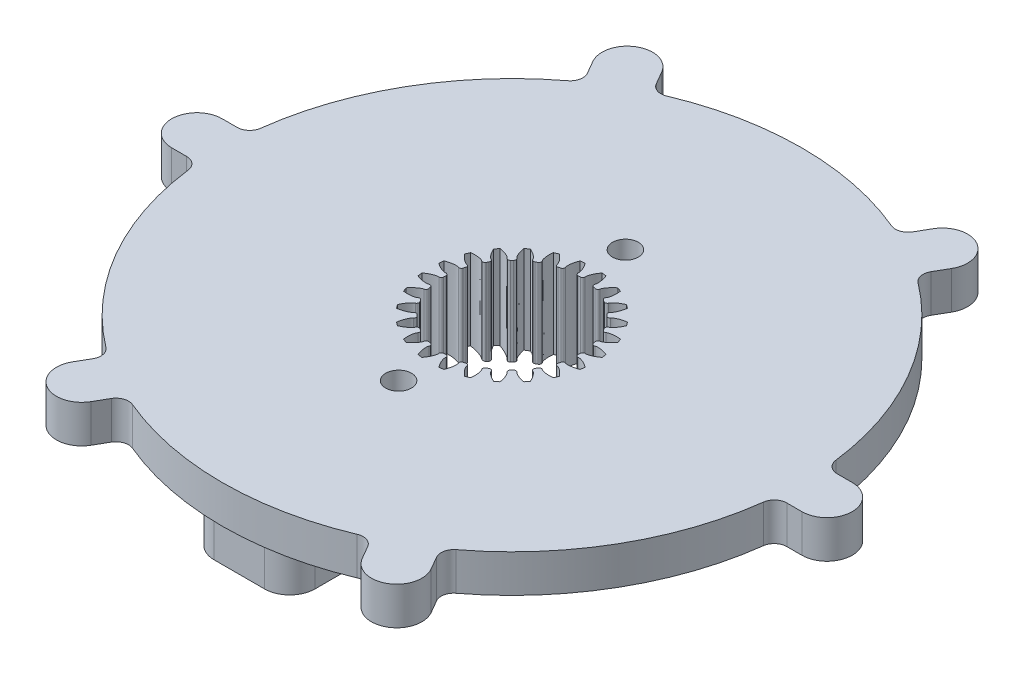
from build123d import *

# Parameters (mm, degrees)
SKETCH8_R                = 23
BOSS_EXTRUDE1_DEPTH      = 1.5
CUT_EXTRUDE1_DEPTH       = 2
CIRPATTERN1_COUNT        = 24
BOSS_EXTRUDE2_DEPTH      = 1.5
FILLET1_R                = 1
CIRPATTERN2_COUNT        = 6
FILLET1_OF_CIRPATTERN2_R = 1
BOSS_EXTRUDE3_START      = 4
SKETCH10_R               = 14
BOSS_EXTRUDE3_DEPTH      = 4
BOSS_EXTRUDE4_REACH      = 38.313
BOSS_EXTRUDE6_DEPTH      = 1.5
M2_5X0_45_TAPPED_HOLE1_D = 2.05
FILLET2_R                = 2
SKETCH24_R               = 7.5
BOSS_EXTRUDE8_DEPTH      = 7
CUT_EXTRUDE3_DEPTH       = 53.873769213
CUT_EXTRUDE4_DEPTH       = 20
CUT_EXTRUDE5_DEPTH       = 10


with BuildPart() as part:
    # Sketch8 → Boss-Extrude1 (new body)
    with BuildSketch(Plane(origin=(0, 0, 0), x_dir=(1, 0, 0), z_dir=(0, 1, 0))):
        with Locations(Location((0, 0, 0), (0, 0, 270))):
            Circle(SKETCH8_R)
    extrude(amount=BOSS_EXTRUDE1_DEPTH)

    # Sketch7 → Cut-Extrude1 (cut)
    with BuildSketch(Plane.XZ):
        with BuildLine():
            Line((0, 0), (0, 5.32))
            ThreePointArc((0, 5.32), (-0.044101515, 5.319817201), (-0.0882, 5.319268818))
            ThreePointArc((-0.0882, 5.319268818), (-0.224581941, 5.373783301), (-0.28135, 5.509242705))
            Line((-0.28135, 5.509242705), (-0.28135, 5.809242705))
            Line((-0.28135, 5.809242705), (-0.67, 6.565904355))
            ThreePointArc((-0.67, 6.565904355), (-0.861472869, 6.543536085), (-1.052210792, 6.51558535))
            Line((-1.052210792, 6.51558535), (-1.231779418, 5.684116298))
            Line((-1.231779418, 5.684116298), (-1.154133705, 5.39433855))
            ThreePointArc((-1.154133705, 5.39433855), (-1.173907966, 5.248802159), (-1.291533418, 5.160846968))
            ThreePointArc((-1.291533418, 5.160846968), (-1.334271216, 5.149963138), (-1.37691732, 5.138725396))
            Line((-1.37691732, 5.138725396), (0, 0))
        make_face()
    cut_extrude1 = extrude(amount=-CUT_EXTRUDE1_DEPTH, mode=Mode.SUBTRACT)

    # CirPattern1: Cut-Extrude1 ×24 about axis
    cirpattern1_axis = Axis((0, 0, 0), (0, 1, 0))
    for i in range(1, CIRPATTERN1_COUNT):
        add(cut_extrude1.rotate(cirpattern1_axis, i * 360 / CIRPATTERN1_COUNT), mode=Mode.SUBTRACT)

    # Sketch9 → Boss-Extrude2 (add)
    with BuildSketch(Plane(origin=(0, 0, 0), x_dir=(1, 0, 0), z_dir=(0, 1, 0))):
        with BuildLine():
            Line((-25, -2), (-22.912878475, -2))
            ThreePointArc((-22.912878475, -2), (-23, 0), (-22.912878475, 2))
            Line((-22.912878475, 2), (-25, 2))
            ThreePointArc((-25, 2), (-27, 0), (-25, -2))
        make_face()
    boss_extrude2 = extrude(amount=BOSS_EXTRUDE2_DEPTH)

    # Fillet1
    fillet1_edges = [part.edges().sort_by_distance(p)[0] for p in [
        (-22.912878475, 0.75, 2),
        (-22.912878475, 0.75, -2),
    ]]
    fillet(fillet1_edges, radius=FILLET1_R)

    # CirPattern2: Boss-Extrude2 ×6 about axis
    cirpattern2_axis = Axis((0, 0, 0), (0, 1, 0))
    for i in range(1, CIRPATTERN2_COUNT):
        add(boss_extrude2.rotate(cirpattern2_axis, i * 360 / CIRPATTERN2_COUNT))

    # Fillet1 of CirPattern2
    fillet1_of_cirpattern2_edges = [part.edges().sort_by_distance(p)[0] for p in [
        (-9.72438843, 0.75, 20.843134833),
        (-13.188490045, 0.75, 18.843134833),
        (13.188490045, 0.75, 18.843134833),
        (9.72438843, 0.75, 20.843134833),
        (22.912878475, 0.75, -2),
        (22.912878475, 0.75, 2),
        (9.72438843, 0.75, -20.843134833),
        (13.188490045, 0.75, -18.843134833),
        (-13.188490045, 0.75, -18.843134833),
        (-9.72438843, 0.75, -20.843134833),
    ]]
    fillet(fillet1_of_cirpattern2_edges, radius=FILLET1_OF_CIRPATTERN2_R)

    # Sketch10 → Boss-Extrude3 (add)
    with BuildSketch(Plane.XZ.offset(BOSS_EXTRUDE3_START)):
        with Locations(Location((0, 0, 0), (0, 0, 90))):
            Circle(SKETCH10_R)
        with BuildLine():
            Line((-0.28135, 5.509242705), (-0.28135, 5.809242705))
            Line((-0.28135, 5.809242705), (-0.67, 6.565904355))
            ThreePointArc((-0.67, 6.565904355), (-0.861472869, 6.543536085), (-1.052210792, 6.51558535))
            Line((-1.052210792, 6.51558535), (-1.231779418, 5.684116298))
            Line((-1.231779418, 5.684116298), (-1.154133705, 5.39433855))
            ThreePointArc((-1.154133705, 5.39433855), (-1.173907966, 5.248802159), (-1.291533418, 5.160846968))
            ThreePointArc((-1.291533418, 5.160846968), (-1.37691732, 5.138725396), (-1.461922734, 5.115191289))
            ThreePointArc((-1.461922734, 5.115191289), (-1.607766959, 5.132549992), (-1.697660167, 5.248701073))
            Line((-1.697660167, 5.248701073), (-1.775305881, 5.538478821))
            Line((-1.775305881, 5.538478821), (-2.346551399, 6.168767829))
            ThreePointArc((-2.346551399, 6.168767829), (-2.525710654, 6.097604915), (-2.702715157, 6.02123997))
            Line((-2.702715157, 6.02123997), (-2.660965105, 5.171626759))
            Line((-2.660965105, 5.171626759), (-2.510965105, 4.911819138))
            ThreePointArc((-2.510965105, 4.911819138), (-2.492397985, 4.766123823), (-2.583250968, 4.650721926))
            ThreePointArc((-2.583250968, 4.650721926), (-2.66, 4.607255148), (-2.73601785, 4.562521926))
            ThreePointArc((-2.73601785, 4.562521926), (-2.881385316, 4.541541883), (-2.9982776, 4.630469138))
            Line((-2.9982776, 4.630469138), (-3.1482776, 4.890276759))
            Line((-3.1482776, 4.890276759), (-3.863189198, 5.35123997))
            ThreePointArc((-3.863189198, 5.35123997), (-4.017825431, 5.236132046), (-4.169033951, 5.116557037))
            Line((-4.169033951, 5.116557037), (-3.908810417, 4.306699403))
            Line((-3.908810417, 4.306699403), (-3.696678383, 4.094567368))
            ThreePointArc((-3.696678383, 4.094567368), (-3.6410352, 3.958642026), (-3.698924234, 3.82365787))
            ThreePointArc((-3.698924234, 3.82365787), (-3.761808076, 3.761808076), (-3.82365787, 3.698924234))
            ThreePointArc((-3.82365787, 3.698924234), (-3.958642026, 3.6410352), (-4.094567368, 3.696678383))
            Line((-4.094567368, 3.696678383), (-4.306699403, 3.908810417))
            Line((-4.306699403, 3.908810417), (-5.116557037, 4.169033951))
            ThreePointArc((-5.116557037, 4.169033951), (-5.236132046, 4.017825431), (-5.35123997, 3.863189198))
            Line((-5.35123997, 3.863189198), (-4.890276759, 3.1482776))
            Line((-4.890276759, 3.1482776), (-4.630469138, 2.9982776))
            ThreePointArc((-4.630469138, 2.9982776), (-4.541541883, 2.881385316), (-4.562521926, 2.73601785))
            ThreePointArc((-4.562521926, 2.73601785), (-4.607255148, 2.66), (-4.650721926, 2.583250968))
            ThreePointArc((-4.650721926, 2.583250968), (-4.766123823, 2.492397985), (-4.911819138, 2.510965105))
            Line((-4.911819138, 2.510965105), (-5.171626759, 2.660965105))
            Line((-5.171626759, 2.660965105), (-6.02123997, 2.702715157))
            ThreePointArc((-6.02123997, 2.702715157), (-6.097604915, 2.525710654), (-6.168767829, 2.346551399))
            Line((-6.168767829, 2.346551399), (-5.538478821, 1.775305881))
            Line((-5.538478821, 1.775305881), (-5.248701073, 1.697660167))
            ThreePointArc((-5.248701073, 1.697660167), (-5.132549992, 1.607766959), (-5.115191289, 1.461922734))
            ThreePointArc((-5.115191289, 1.461922734), (-5.138725396, 1.37691732), (-5.160846968, 1.291533418))
            ThreePointArc((-5.160846968, 1.291533418), (-5.248802159, 1.173907966), (-5.39433855, 1.154133705))
            Line((-5.39433855, 1.154133705), (-5.684116298, 1.231779418))
            Line((-5.684116298, 1.231779418), (-6.51558535, 1.052210792))
            ThreePointArc((-6.51558535, 1.052210792), (-6.543536085, 0.861472869), (-6.565904355, 0.67))
            Line((-6.565904355, 0.67), (-5.809242705, 0.28135))
            Line((-5.809242705, 0.28135), (-5.509242705, 0.28135))
            ThreePointArc((-5.509242705, 0.28135), (-5.373783301, 0.224581941), (-5.319268818, 0.0882))
            ThreePointArc((-5.319268818, 0.0882), (-5.32, 0), (-5.319268818, -0.0882))
            ThreePointArc((-5.319268818, -0.0882), (-5.373783301, -0.224581941), (-5.509242705, -0.28135))
            Line((-5.509242705, -0.28135), (-5.809242705, -0.28135))
            Line((-5.809242705, -0.28135), (-6.565904355, -0.67))
            ThreePointArc((-6.565904355, -0.67), (-6.543536085, -0.861472869), (-6.51558535, -1.052210792))
            Line((-6.51558535, -1.052210792), (-5.684116298, -1.231779418))
            Line((-5.684116298, -1.231779418), (-5.39433855, -1.154133705))
            ThreePointArc((-5.39433855, -1.154133705), (-5.248802159, -1.173907966), (-5.160846968, -1.291533418))
            ThreePointArc((-5.160846968, -1.291533418), (-5.138725396, -1.37691732), (-5.115191289, -1.461922734))
            ThreePointArc((-5.115191289, -1.461922734), (-5.132549992, -1.607766959), (-5.248701073, -1.697660167))
            Line((-5.248701073, -1.697660167), (-5.538478821, -1.775305881))
            Line((-5.538478821, -1.775305881), (-6.168767829, -2.346551399))
            ThreePointArc((-6.168767829, -2.346551399), (-6.097604915, -2.525710654), (-6.02123997, -2.702715157))
            Line((-6.02123997, -2.702715157), (-5.171626759, -2.660965105))
            Line((-5.171626759, -2.660965105), (-4.911819138, -2.510965105))
            ThreePointArc((-4.911819138, -2.510965105), (-4.766123823, -2.492397985), (-4.650721926, -2.583250968))
            ThreePointArc((-4.650721926, -2.583250968), (-4.607255148, -2.66), (-4.562521926, -2.73601785))
            ThreePointArc((-4.562521926, -2.73601785), (-4.541541883, -2.881385316), (-4.630469138, -2.9982776))
            Line((-4.630469138, -2.9982776), (-4.890276759, -3.1482776))
            Line((-4.890276759, -3.1482776), (-5.35123997, -3.863189198))
            ThreePointArc((-5.35123997, -3.863189198), (-5.236132046, -4.017825431), (-5.116557037, -4.169033951))
            Line((-5.116557037, -4.169033951), (-4.306699403, -3.908810417))
            Line((-4.306699403, -3.908810417), (-4.094567368, -3.696678383))
            ThreePointArc((-4.094567368, -3.696678383), (-3.958642026, -3.6410352), (-3.82365787, -3.698924234))
            ThreePointArc((-3.82365787, -3.698924234), (-3.761808076, -3.761808076), (-3.698924234, -3.82365787))
            ThreePointArc((-3.698924234, -3.82365787), (-3.6410352, -3.958642026), (-3.696678383, -4.094567368))
            Line((-3.696678383, -4.094567368), (-3.908810417, -4.306699403))
            Line((-3.908810417, -4.306699403), (-4.169033951, -5.116557037))
            ThreePointArc((-4.169033951, -5.116557037), (-4.017825431, -5.236132046), (-3.863189198, -5.35123997))
            Line((-3.863189198, -5.35123997), (-3.1482776, -4.890276759))
            Line((-3.1482776, -4.890276759), (-2.9982776, -4.630469138))
            ThreePointArc((-2.9982776, -4.630469138), (-2.881385316, -4.541541883), (-2.73601785, -4.562521926))
            ThreePointArc((-2.73601785, -4.562521926), (-2.66, -4.607255148), (-2.583250968, -4.650721926))
            ThreePointArc((-2.583250968, -4.650721926), (-2.492397985, -4.766123823), (-2.510965105, -4.911819138))
            Line((-2.510965105, -4.911819138), (-2.660965105, -5.171626759))
            Line((-2.660965105, -5.171626759), (-2.702715157, -6.02123997))
            ThreePointArc((-2.702715157, -6.02123997), (-2.525710654, -6.097604915), (-2.346551399, -6.168767829))
            Line((-2.346551399, -6.168767829), (-1.775305881, -5.538478821))
            Line((-1.775305881, -5.538478821), (-1.697660167, -5.248701073))
            ThreePointArc((-1.697660167, -5.248701073), (-1.607766959, -5.132549992), (-1.461922734, -5.115191289))
            ThreePointArc((-1.461922734, -5.115191289), (-1.37691732, -5.138725396), (-1.291533418, -5.160846968))
            ThreePointArc((-1.291533418, -5.160846968), (-1.173907966, -5.248802159), (-1.154133705, -5.39433855))
            Line((-1.154133705, -5.39433855), (-1.231779418, -5.684116298))
            Line((-1.231779418, -5.684116298), (-1.052210792, -6.51558535))
            ThreePointArc((-1.052210792, -6.51558535), (-0.861472869, -6.543536085), (-0.67, -6.565904355))
            Line((-0.67, -6.565904355), (-0.28135, -5.809242705))
            Line((-0.28135, -5.809242705), (-0.28135, -5.509242705))
            ThreePointArc((-0.28135, -5.509242705), (-0.224581941, -5.373783301), (-0.0882, -5.319268818))
            ThreePointArc((-0.0882, -5.319268818), (0, -5.32), (0.0882, -5.319268818))
            ThreePointArc((0.0882, -5.319268818), (0.224581941, -5.373783301), (0.28135, -5.509242705))
            Line((0.28135, -5.509242705), (0.28135, -5.809242705))
            Line((0.28135, -5.809242705), (0.67, -6.565904355))
            ThreePointArc((0.67, -6.565904355), (0.861472869, -6.543536085), (1.052210792, -6.51558535))
            Line((1.052210792, -6.51558535), (1.231779418, -5.684116298))
            Line((1.231779418, -5.684116298), (1.154133705, -5.39433855))
            ThreePointArc((1.154133705, -5.39433855), (1.173907966, -5.248802159), (1.291533418, -5.160846968))
            ThreePointArc((1.291533418, -5.160846968), (1.37691732, -5.138725396), (1.461922734, -5.115191289))
            ThreePointArc((1.461922734, -5.115191289), (1.607766959, -5.132549992), (1.697660167, -5.248701073))
            Line((1.697660167, -5.248701073), (1.775305881, -5.538478821))
            Line((1.775305881, -5.538478821), (2.346551399, -6.168767829))
            ThreePointArc((2.346551399, -6.168767829), (2.525710654, -6.097604915), (2.702715157, -6.02123997))
            Line((2.702715157, -6.02123997), (2.660965105, -5.171626759))
            Line((2.660965105, -5.171626759), (2.510965105, -4.911819138))
            ThreePointArc((2.510965105, -4.911819138), (2.492397985, -4.766123823), (2.583250968, -4.650721926))
            ThreePointArc((2.583250968, -4.650721926), (2.66, -4.607255148), (2.73601785, -4.562521926))
            ThreePointArc((2.73601785, -4.562521926), (2.881385316, -4.541541883), (2.9982776, -4.630469138))
            Line((2.9982776, -4.630469138), (3.1482776, -4.890276759))
            Line((3.1482776, -4.890276759), (3.863189198, -5.35123997))
            ThreePointArc((3.863189198, -5.35123997), (4.017825431, -5.236132046), (4.169033951, -5.116557037))
            Line((4.169033951, -5.116557037), (3.908810417, -4.306699403))
            Line((3.908810417, -4.306699403), (3.696678383, -4.094567368))
            ThreePointArc((3.696678383, -4.094567368), (3.6410352, -3.958642026), (3.698924234, -3.82365787))
            ThreePointArc((3.698924234, -3.82365787), (3.761808076, -3.761808076), (3.82365787, -3.698924234))
            ThreePointArc((3.82365787, -3.698924234), (3.958642026, -3.6410352), (4.094567368, -3.696678383))
            Line((4.094567368, -3.696678383), (4.306699403, -3.908810417))
            Line((4.306699403, -3.908810417), (5.116557037, -4.169033951))
            ThreePointArc((5.116557037, -4.169033951), (5.236132046, -4.017825431), (5.35123997, -3.863189198))
            Line((5.35123997, -3.863189198), (4.890276759, -3.1482776))
            Line((4.890276759, -3.1482776), (4.630469138, -2.9982776))
            ThreePointArc((4.630469138, -2.9982776), (4.541541883, -2.881385316), (4.562521926, -2.73601785))
            ThreePointArc((4.562521926, -2.73601785), (4.607255148, -2.66), (4.650721926, -2.583250968))
            ThreePointArc((4.650721926, -2.583250968), (4.766123823, -2.492397985), (4.911819138, -2.510965105))
            Line((4.911819138, -2.510965105), (5.171626759, -2.660965105))
            Line((5.171626759, -2.660965105), (6.02123997, -2.702715157))
            ThreePointArc((6.02123997, -2.702715157), (6.097604915, -2.525710654), (6.168767829, -2.346551399))
            Line((6.168767829, -2.346551399), (5.538478821, -1.775305881))
            Line((5.538478821, -1.775305881), (5.248701073, -1.697660167))
            ThreePointArc((5.248701073, -1.697660167), (5.132549992, -1.607766959), (5.115191289, -1.461922734))
            ThreePointArc((5.115191289, -1.461922734), (5.138725396, -1.37691732), (5.160846968, -1.291533418))
            ThreePointArc((5.160846968, -1.291533418), (5.248802159, -1.173907966), (5.39433855, -1.154133705))
            Line((5.39433855, -1.154133705), (5.684116298, -1.231779418))
            Line((5.684116298, -1.231779418), (6.51558535, -1.052210792))
            ThreePointArc((6.51558535, -1.052210792), (6.543536085, -0.861472869), (6.565904355, -0.67))
            Line((6.565904355, -0.67), (5.809242705, -0.28135))
            Line((5.809242705, -0.28135), (5.509242705, -0.28135))
            ThreePointArc((5.509242705, -0.28135), (5.373783301, -0.224581941), (5.319268818, -0.0882))
            ThreePointArc((5.319268818, -0.0882), (5.32, 0), (5.319268818, 0.0882))
            ThreePointArc((5.319268818, 0.0882), (5.373783301, 0.224581941), (5.509242705, 0.28135))
            Line((5.509242705, 0.28135), (5.809242705, 0.28135))
            Line((5.809242705, 0.28135), (6.565904355, 0.67))
            ThreePointArc((6.565904355, 0.67), (6.543536085, 0.861472869), (6.51558535, 1.052210792))
            Line((6.51558535, 1.052210792), (5.684116298, 1.231779418))
            Line((5.684116298, 1.231779418), (5.39433855, 1.154133705))
            ThreePointArc((5.39433855, 1.154133705), (5.248802159, 1.173907966), (5.160846968, 1.291533418))
            ThreePointArc((5.160846968, 1.291533418), (5.138725396, 1.37691732), (5.115191289, 1.461922734))
            ThreePointArc((5.115191289, 1.461922734), (5.132549992, 1.607766959), (5.248701073, 1.697660167))
            Line((5.248701073, 1.697660167), (5.538478821, 1.775305881))
            Line((5.538478821, 1.775305881), (6.168767829, 2.346551399))
            ThreePointArc((6.168767829, 2.346551399), (6.097604915, 2.525710654), (6.02123997, 2.702715157))
            Line((6.02123997, 2.702715157), (5.171626759, 2.660965105))
            Line((5.171626759, 2.660965105), (4.911819138, 2.510965105))
            ThreePointArc((4.911819138, 2.510965105), (4.766123823, 2.492397985), (4.650721926, 2.583250968))
            ThreePointArc((4.650721926, 2.583250968), (4.607255148, 2.66), (4.562521926, 2.73601785))
            ThreePointArc((4.562521926, 2.73601785), (4.541541883, 2.881385316), (4.630469138, 2.9982776))
            Line((4.630469138, 2.9982776), (4.890276759, 3.1482776))
            Line((4.890276759, 3.1482776), (5.35123997, 3.863189198))
            ThreePointArc((5.35123997, 3.863189198), (5.236132046, 4.017825431), (5.116557037, 4.169033951))
            Line((5.116557037, 4.169033951), (4.306699403, 3.908810417))
            Line((4.306699403, 3.908810417), (4.094567368, 3.696678383))
            ThreePointArc((4.094567368, 3.696678383), (3.958642026, 3.6410352), (3.82365787, 3.698924234))
            ThreePointArc((3.82365787, 3.698924234), (3.761808076, 3.761808076), (3.698924234, 3.82365787))
            ThreePointArc((3.698924234, 3.82365787), (3.6410352, 3.958642026), (3.696678383, 4.094567368))
            Line((3.696678383, 4.094567368), (3.908810417, 4.306699403))
            Line((3.908810417, 4.306699403), (4.169033951, 5.116557037))
            ThreePointArc((4.169033951, 5.116557037), (4.017825431, 5.236132046), (3.863189198, 5.35123997))
            Line((3.863189198, 5.35123997), (3.1482776, 4.890276759))
            Line((3.1482776, 4.890276759), (2.9982776, 4.630469138))
            ThreePointArc((2.9982776, 4.630469138), (2.881385316, 4.541541883), (2.73601785, 4.562521926))
            ThreePointArc((2.73601785, 4.562521926), (2.66, 4.607255148), (2.583250968, 4.650721926))
            ThreePointArc((2.583250968, 4.650721926), (2.492397985, 4.766123823), (2.510965105, 4.911819138))
            Line((2.510965105, 4.911819138), (2.660965105, 5.171626759))
            Line((2.660965105, 5.171626759), (2.702715157, 6.02123997))
            ThreePointArc((2.702715157, 6.02123997), (2.525710654, 6.097604915), (2.346551399, 6.168767829))
            Line((2.346551399, 6.168767829), (1.775305881, 5.538478821))
            Line((1.775305881, 5.538478821), (1.697660167, 5.248701073))
            ThreePointArc((1.697660167, 5.248701073), (1.607766959, 5.132549992), (1.461922734, 5.115191289))
            ThreePointArc((1.461922734, 5.115191289), (1.37691732, 5.138725396), (1.291533418, 5.160846968))
            ThreePointArc((1.291533418, 5.160846968), (1.173907966, 5.248802159), (1.154133705, 5.39433855))
            Line((1.154133705, 5.39433855), (1.231779418, 5.684116298))
            Line((1.231779418, 5.684116298), (1.052210792, 6.51558535))
            ThreePointArc((1.052210792, 6.51558535), (0.861472869, 6.543536085), (0.67, 6.565904355))
            Line((0.67, 6.565904355), (0.28135, 5.809242705))
            Line((0.28135, 5.809242705), (0.28135, 5.509242705))
            ThreePointArc((0.28135, 5.509242705), (0.224581941, 5.373783301), (0.0882, 5.319268818))
            ThreePointArc((0.0882, 5.319268818), (0, 5.32), (-0.0882, 5.319268818))
            ThreePointArc((-0.0882, 5.319268818), (-0.224581941, 5.373783301), (-0.28135, 5.509242705))
        make_face(mode=Mode.SUBTRACT)
    extrude(amount=-BOSS_EXTRUDE3_DEPTH)

    # Sketch11 → Boss-Extrude4 (add, up to next)
    with BuildSketch(Plane.XZ.offset(4), mode=Mode.PRIVATE) as boss_extrude4_sk1:
        with BuildLine():
            ThreePointArc((-4, 13.416407865), (0, 14), (4, 13.416407865))
            Line((4, 13.416407865), (4, 21.633307653))
            Line((4, 21.633307653), (-4, 21.633307653))
            Line((-4, 21.633307653), (-4, 13.416407865))
        make_face()
    boss_extrude4_tool1 = extrude(boss_extrude4_sk1.sketch, amount=-BOSS_EXTRUDE4_REACH, mode=Mode.PRIVATE) - part.part
    add(boss_extrude4_tool1.solids().sort_by_distance((0, -4, 17.718292))[0])

    # Sketch13 → Boss-Extrude6 (add)
    with BuildSketch(Plane(origin=(0, 1.5, 0), x_dir=(1, 0, 0), z_dir=(0, 1, 0))):
        with BuildLine():
            Line((-10.173830092, 21.621590627), (-10.767949192, 22.650635095))
            ThreePointArc((-10.767949192, 22.650635095), (-13.5, 23.382685902), (-14.232050808, 20.650635095))
            Line((-14.232050808, 20.650635095), (-13.637931707, 19.621590627))
            ThreePointArc((-13.637931707, 19.621590627), (-13.523719144, 18.923768665), (-13.899625565, 18.324857684))
            ThreePointArc((-13.899625565, 18.324857684), (-19.918584287, 11.5), (-22.819605058, 2.875))
            ThreePointArc((-22.819605058, 2.875), (-23.150323972, 2.25), (-23.8117618, 2))
            Line((-23.8117618, 2), (-25, 2))
            ThreePointArc((-25, 2), (-27, 0), (-25, -2))
            Line((-25, -2), (-23.8117618, -2))
            ThreePointArc((-23.8117618, -2), (-23.150323972, -2.25), (-22.819605058, -2.875))
            ThreePointArc((-22.819605058, -2.875), (-19.918584287, -11.5), (-13.899625565, -18.324857684))
            ThreePointArc((-13.899625565, -18.324857684), (-13.523719144, -18.923768665), (-13.637931707, -19.621590627))
            Line((-13.637931707, -19.621590627), (-14.232050808, -20.650635095))
            ThreePointArc((-14.232050808, -20.650635095), (-13.5, -23.382685902), (-10.767949192, -22.650635095))
            Line((-10.767949192, -22.650635095), (-10.173830092, -21.621590627))
            ThreePointArc((-10.173830092, -21.621590627), (-9.626604827, -21.173768665), (-8.919979493, -21.199857684))
            ThreePointArc((-8.919979493, -21.199857684), (0, -23), (8.919979493, -21.199857684))
            ThreePointArc((8.919979493, -21.199857684), (9.626604827, -21.173768665), (10.173830092, -21.621590627))
            Line((10.173830092, -21.621590627), (10.767949192, -22.650635095))
            ThreePointArc((10.767949192, -22.650635095), (13.5, -23.382685902), (14.232050808, -20.650635095))
            Line((14.232050808, -20.650635095), (13.637931707, -19.621590627))
            ThreePointArc((13.637931707, -19.621590627), (13.523719144, -18.923768665), (13.899625565, -18.324857684))
            ThreePointArc((13.899625565, -18.324857684), (19.918584287, -11.5), (22.819605058, -2.875))
            ThreePointArc((22.819605058, -2.875), (23.150323972, -2.25), (23.8117618, -2))
            Line((23.8117618, -2), (25, -2))
            ThreePointArc((25, -2), (27, 0), (25, 2))
            Line((25, 2), (23.8117618, 2))
            ThreePointArc((23.8117618, 2), (23.150323972, 2.25), (22.819605058, 2.875))
            ThreePointArc((22.819605058, 2.875), (19.918584287, 11.5), (13.899625565, 18.324857684))
            ThreePointArc((13.899625565, 18.324857684), (13.523719144, 18.923768665), (13.637931707, 19.621590627))
            Line((13.637931707, 19.621590627), (14.232050808, 20.650635095))
            ThreePointArc((14.232050808, 20.650635095), (13.5, 23.382685902), (10.767949192, 22.650635095))
            Line((10.767949192, 22.650635095), (10.173830092, 21.621590627))
            ThreePointArc((10.173830092, 21.621590627), (9.626604827, 21.173768665), (8.919979493, 21.199857684))
            ThreePointArc((8.919979493, 21.199857684), (0, 23), (-8.919979493, 21.199857684))
            ThreePointArc((-8.919979493, 21.199857684), (-9.626604827, 21.173768665), (-10.173830092, 21.621590627))
        make_face()
        with BuildLine():
            Line((-1.775305881, -5.538478821), (-1.697660167, -5.248701073))
            ThreePointArc((-1.697660167, -5.248701073), (-1.607766959, -5.132549992), (-1.461922734, -5.115191289))
            ThreePointArc((-1.461922734, -5.115191289), (-1.37691732, -5.138725396), (-1.291533418, -5.160846968))
            ThreePointArc((-1.291533418, -5.160846968), (-1.173907966, -5.248802159), (-1.154133705, -5.39433855))
            Line((-1.154133705, -5.39433855), (-1.231779418, -5.684116298))
            Line((-1.231779418, -5.684116298), (-1.052210792, -6.51558535))
            ThreePointArc((-1.052210792, -6.51558535), (-0.861472869, -6.543536085), (-0.67, -6.565904355))
            Line((-0.67, -6.565904355), (-0.28135, -5.809242705))
            Line((-0.28135, -5.809242705), (-0.28135, -5.509242705))
            ThreePointArc((-0.28135, -5.509242705), (-0.224581941, -5.373783301), (-0.0882, -5.319268818))
            ThreePointArc((-0.0882, -5.319268818), (0, -5.32), (0.0882, -5.319268818))
            ThreePointArc((0.0882, -5.319268818), (0.224581941, -5.373783301), (0.28135, -5.509242705))
            Line((0.28135, -5.509242705), (0.28135, -5.809242705))
            Line((0.28135, -5.809242705), (0.67, -6.565904355))
            ThreePointArc((0.67, -6.565904355), (0.861472869, -6.543536085), (1.052210792, -6.51558535))
            Line((1.052210792, -6.51558535), (1.231779418, -5.684116298))
            Line((1.231779418, -5.684116298), (1.154133705, -5.39433855))
            ThreePointArc((1.154133705, -5.39433855), (1.173907966, -5.248802159), (1.291533418, -5.160846968))
            ThreePointArc((1.291533418, -5.160846968), (1.37691732, -5.138725396), (1.461922734, -5.115191289))
            ThreePointArc((1.461922734, -5.115191289), (1.607766959, -5.132549992), (1.697660167, -5.248701073))
            Line((1.697660167, -5.248701073), (1.775305881, -5.538478821))
            Line((1.775305881, -5.538478821), (2.346551399, -6.168767829))
            ThreePointArc((2.346551399, -6.168767829), (2.525710654, -6.097604915), (2.702715157, -6.02123997))
            Line((2.702715157, -6.02123997), (2.660965105, -5.171626759))
            Line((2.660965105, -5.171626759), (2.510965105, -4.911819138))
            ThreePointArc((2.510965105, -4.911819138), (2.492397985, -4.766123823), (2.583250968, -4.650721926))
            ThreePointArc((2.583250968, -4.650721926), (2.66, -4.607255148), (2.73601785, -4.562521926))
            ThreePointArc((2.73601785, -4.562521926), (2.881385316, -4.541541883), (2.9982776, -4.630469138))
            Line((2.9982776, -4.630469138), (3.1482776, -4.890276759))
            Line((3.1482776, -4.890276759), (3.863189198, -5.35123997))
            ThreePointArc((3.863189198, -5.35123997), (4.017825431, -5.236132046), (4.169033951, -5.116557037))
            Line((4.169033951, -5.116557037), (3.908810417, -4.306699403))
            Line((3.908810417, -4.306699403), (3.696678383, -4.094567368))
            ThreePointArc((3.696678383, -4.094567368), (3.6410352, -3.958642026), (3.698924234, -3.82365787))
            ThreePointArc((3.698924234, -3.82365787), (3.761808076, -3.761808076), (3.82365787, -3.698924234))
            ThreePointArc((3.82365787, -3.698924234), (3.958642026, -3.6410352), (4.094567368, -3.696678383))
            Line((4.094567368, -3.696678383), (4.306699403, -3.908810417))
            Line((4.306699403, -3.908810417), (5.116557037, -4.169033951))
            ThreePointArc((5.116557037, -4.169033951), (5.236132046, -4.017825431), (5.35123997, -3.863189198))
            Line((5.35123997, -3.863189198), (4.890276759, -3.1482776))
            Line((4.890276759, -3.1482776), (4.630469138, -2.9982776))
            ThreePointArc((4.630469138, -2.9982776), (4.541541883, -2.881385316), (4.562521926, -2.73601785))
            ThreePointArc((4.562521926, -2.73601785), (4.607255148, -2.66), (4.650721926, -2.583250968))
            ThreePointArc((4.650721926, -2.583250968), (4.766123823, -2.492397985), (4.911819138, -2.510965105))
            Line((4.911819138, -2.510965105), (5.171626759, -2.660965105))
            Line((5.171626759, -2.660965105), (6.02123997, -2.702715157))
            ThreePointArc((6.02123997, -2.702715157), (6.097604915, -2.525710654), (6.168767829, -2.346551399))
            Line((6.168767829, -2.346551399), (5.538478821, -1.775305881))
            Line((5.538478821, -1.775305881), (5.248701073, -1.697660167))
            ThreePointArc((5.248701073, -1.697660167), (5.132549992, -1.607766959), (5.115191289, -1.461922734))
            ThreePointArc((5.115191289, -1.461922734), (5.138725396, -1.37691732), (5.160846968, -1.291533418))
            ThreePointArc((5.160846968, -1.291533418), (5.248802159, -1.173907966), (5.39433855, -1.154133705))
            Line((5.39433855, -1.154133705), (5.684116298, -1.231779418))
            Line((5.684116298, -1.231779418), (6.51558535, -1.052210792))
            ThreePointArc((6.51558535, -1.052210792), (6.543536085, -0.861472869), (6.565904355, -0.67))
            Line((6.565904355, -0.67), (5.809242705, -0.28135))
            Line((5.809242705, -0.28135), (5.509242705, -0.28135))
            ThreePointArc((5.509242705, -0.28135), (5.373783301, -0.224581941), (5.319268818, -0.0882))
            ThreePointArc((5.319268818, -0.0882), (5.32, 0), (5.319268818, 0.0882))
            ThreePointArc((5.319268818, 0.0882), (5.373783301, 0.224581941), (5.509242705, 0.28135))
            Line((5.509242705, 0.28135), (5.809242705, 0.28135))
            Line((5.809242705, 0.28135), (6.565904355, 0.67))
            ThreePointArc((6.565904355, 0.67), (6.543536085, 0.861472869), (6.51558535, 1.052210792))
            Line((6.51558535, 1.052210792), (5.684116298, 1.231779418))
            Line((5.684116298, 1.231779418), (5.39433855, 1.154133705))
            ThreePointArc((5.39433855, 1.154133705), (5.248802159, 1.173907966), (5.160846968, 1.291533418))
            ThreePointArc((5.160846968, 1.291533418), (5.138725396, 1.37691732), (5.115191289, 1.461922734))
            ThreePointArc((5.115191289, 1.461922734), (5.132549992, 1.607766959), (5.248701073, 1.697660167))
            Line((5.248701073, 1.697660167), (5.538478821, 1.775305881))
            Line((5.538478821, 1.775305881), (6.168767829, 2.346551399))
            ThreePointArc((6.168767829, 2.346551399), (6.097604915, 2.525710654), (6.02123997, 2.702715157))
            Line((6.02123997, 2.702715157), (5.171626759, 2.660965105))
            Line((5.171626759, 2.660965105), (4.911819138, 2.510965105))
            ThreePointArc((4.911819138, 2.510965105), (4.766123823, 2.492397985), (4.650721926, 2.583250968))
            ThreePointArc((4.650721926, 2.583250968), (4.607255148, 2.66), (4.562521926, 2.73601785))
            ThreePointArc((4.562521926, 2.73601785), (4.541541883, 2.881385316), (4.630469138, 2.9982776))
            Line((4.630469138, 2.9982776), (4.890276759, 3.1482776))
            Line((4.890276759, 3.1482776), (5.35123997, 3.863189198))
            ThreePointArc((5.35123997, 3.863189198), (5.236132046, 4.017825431), (5.116557037, 4.169033951))
            Line((5.116557037, 4.169033951), (4.306699403, 3.908810417))
            Line((4.306699403, 3.908810417), (4.094567368, 3.696678383))
            ThreePointArc((4.094567368, 3.696678383), (3.958642026, 3.6410352), (3.82365787, 3.698924234))
            ThreePointArc((3.82365787, 3.698924234), (3.761808076, 3.761808076), (3.698924234, 3.82365787))
            ThreePointArc((3.698924234, 3.82365787), (3.6410352, 3.958642026), (3.696678383, 4.094567368))
            Line((3.696678383, 4.094567368), (3.908810417, 4.306699403))
            Line((3.908810417, 4.306699403), (4.169033951, 5.116557037))
            ThreePointArc((4.169033951, 5.116557037), (4.017825431, 5.236132046), (3.863189198, 5.35123997))
            Line((3.863189198, 5.35123997), (3.1482776, 4.890276759))
            Line((3.1482776, 4.890276759), (2.9982776, 4.630469138))
            ThreePointArc((2.9982776, 4.630469138), (2.881385316, 4.541541883), (2.73601785, 4.562521926))
            ThreePointArc((2.73601785, 4.562521926), (2.66, 4.607255148), (2.583250968, 4.650721926))
            ThreePointArc((2.583250968, 4.650721926), (2.492397985, 4.766123823), (2.510965105, 4.911819138))
            Line((2.510965105, 4.911819138), (2.660965105, 5.171626759))
            Line((2.660965105, 5.171626759), (2.702715157, 6.02123997))
            ThreePointArc((2.702715157, 6.02123997), (2.525710654, 6.097604915), (2.346551399, 6.168767829))
            Line((2.346551399, 6.168767829), (1.775305881, 5.538478821))
            Line((1.775305881, 5.538478821), (1.697660167, 5.248701073))
            ThreePointArc((1.697660167, 5.248701073), (1.607766959, 5.132549992), (1.461922734, 5.115191289))
            ThreePointArc((1.461922734, 5.115191289), (1.37691732, 5.138725396), (1.291533418, 5.160846968))
            ThreePointArc((1.291533418, 5.160846968), (1.173907966, 5.248802159), (1.154133705, 5.39433855))
            Line((1.154133705, 5.39433855), (1.231779418, 5.684116298))
            Line((1.231779418, 5.684116298), (1.052210792, 6.51558535))
            ThreePointArc((1.052210792, 6.51558535), (0.861472869, 6.543536085), (0.67, 6.565904355))
            Line((0.67, 6.565904355), (0.28135, 5.809242705))
            Line((0.28135, 5.809242705), (0.28135, 5.509242705))
            ThreePointArc((0.28135, 5.509242705), (0.224581941, 5.373783301), (0.0882, 5.319268818))
            ThreePointArc((0.0882, 5.319268818), (0, 5.32), (-0.0882, 5.319268818))
            ThreePointArc((-0.0882, 5.319268818), (-0.224581941, 5.373783301), (-0.28135, 5.509242705))
            Line((-0.28135, 5.509242705), (-0.28135, 5.809242705))
            Line((-0.28135, 5.809242705), (-0.67, 6.565904355))
            ThreePointArc((-0.67, 6.565904355), (-0.861472869, 6.543536085), (-1.052210792, 6.51558535))
            Line((-1.052210792, 6.51558535), (-1.231779418, 5.684116298))
            Line((-1.231779418, 5.684116298), (-1.154133705, 5.39433855))
            ThreePointArc((-1.154133705, 5.39433855), (-1.173907966, 5.248802159), (-1.291533418, 5.160846968))
            ThreePointArc((-1.291533418, 5.160846968), (-1.37691732, 5.138725396), (-1.461922734, 5.115191289))
            ThreePointArc((-1.461922734, 5.115191289), (-1.607766959, 5.132549992), (-1.697660167, 5.248701073))
            Line((-1.697660167, 5.248701073), (-1.775305881, 5.538478821))
            Line((-1.775305881, 5.538478821), (-2.346551399, 6.168767829))
            ThreePointArc((-2.346551399, 6.168767829), (-2.525710654, 6.097604915), (-2.702715157, 6.02123997))
            Line((-2.702715157, 6.02123997), (-2.660965105, 5.171626759))
            Line((-2.660965105, 5.171626759), (-2.510965105, 4.911819138))
            ThreePointArc((-2.510965105, 4.911819138), (-2.492397985, 4.766123823), (-2.583250968, 4.650721926))
            ThreePointArc((-2.583250968, 4.650721926), (-2.66, 4.607255148), (-2.73601785, 4.562521926))
            ThreePointArc((-2.73601785, 4.562521926), (-2.881385316, 4.541541883), (-2.9982776, 4.630469138))
            Line((-2.9982776, 4.630469138), (-3.1482776, 4.890276759))
            Line((-3.1482776, 4.890276759), (-3.863189198, 5.35123997))
            ThreePointArc((-3.863189198, 5.35123997), (-4.017825431, 5.236132046), (-4.169033951, 5.116557037))
            Line((-4.169033951, 5.116557037), (-3.908810417, 4.306699403))
            Line((-3.908810417, 4.306699403), (-3.696678383, 4.094567368))
            ThreePointArc((-3.696678383, 4.094567368), (-3.6410352, 3.958642026), (-3.698924234, 3.82365787))
            ThreePointArc((-3.698924234, 3.82365787), (-3.761808076, 3.761808076), (-3.82365787, 3.698924234))
            ThreePointArc((-3.82365787, 3.698924234), (-3.958642026, 3.6410352), (-4.094567368, 3.696678383))
            Line((-4.094567368, 3.696678383), (-4.306699403, 3.908810417))
            Line((-4.306699403, 3.908810417), (-5.116557037, 4.169033951))
            ThreePointArc((-5.116557037, 4.169033951), (-5.236132046, 4.017825431), (-5.35123997, 3.863189198))
            Line((-5.35123997, 3.863189198), (-4.890276759, 3.1482776))
            Line((-4.890276759, 3.1482776), (-4.630469138, 2.9982776))
            ThreePointArc((-4.630469138, 2.9982776), (-4.541541883, 2.881385316), (-4.562521926, 2.73601785))
            ThreePointArc((-4.562521926, 2.73601785), (-4.607255148, 2.66), (-4.650721926, 2.583250968))
            ThreePointArc((-4.650721926, 2.583250968), (-4.766123823, 2.492397985), (-4.911819138, 2.510965105))
            Line((-4.911819138, 2.510965105), (-5.171626759, 2.660965105))
            Line((-5.171626759, 2.660965105), (-6.02123997, 2.702715157))
            ThreePointArc((-6.02123997, 2.702715157), (-6.097604915, 2.525710654), (-6.168767829, 2.346551399))
            Line((-6.168767829, 2.346551399), (-5.538478821, 1.775305881))
            Line((-5.538478821, 1.775305881), (-5.248701073, 1.697660167))
            ThreePointArc((-5.248701073, 1.697660167), (-5.132549992, 1.607766959), (-5.115191289, 1.461922734))
            ThreePointArc((-5.115191289, 1.461922734), (-5.138725396, 1.37691732), (-5.160846968, 1.291533418))
            ThreePointArc((-5.160846968, 1.291533418), (-5.248802159, 1.173907966), (-5.39433855, 1.154133705))
            Line((-5.39433855, 1.154133705), (-5.684116298, 1.231779418))
            Line((-5.684116298, 1.231779418), (-6.51558535, 1.052210792))
            ThreePointArc((-6.51558535, 1.052210792), (-6.543536085, 0.861472869), (-6.565904355, 0.67))
            Line((-6.565904355, 0.67), (-5.809242705, 0.28135))
            Line((-5.809242705, 0.28135), (-5.509242705, 0.28135))
            ThreePointArc((-5.509242705, 0.28135), (-5.373783301, 0.224581941), (-5.319268818, 0.0882))
            ThreePointArc((-5.319268818, 0.0882), (-5.32, 0), (-5.319268818, -0.0882))
            ThreePointArc((-5.319268818, -0.0882), (-5.373783301, -0.224581941), (-5.509242705, -0.28135))
            Line((-5.509242705, -0.28135), (-5.809242705, -0.28135))
            Line((-5.809242705, -0.28135), (-6.565904355, -0.67))
            ThreePointArc((-6.565904355, -0.67), (-6.543536085, -0.861472869), (-6.51558535, -1.052210792))
            Line((-6.51558535, -1.052210792), (-5.684116298, -1.231779418))
            Line((-5.684116298, -1.231779418), (-5.39433855, -1.154133705))
            ThreePointArc((-5.39433855, -1.154133705), (-5.248802159, -1.173907966), (-5.160846968, -1.291533418))
            ThreePointArc((-5.160846968, -1.291533418), (-5.138725396, -1.37691732), (-5.115191289, -1.461922734))
            ThreePointArc((-5.115191289, -1.461922734), (-5.132549992, -1.607766959), (-5.248701073, -1.697660167))
            Line((-5.248701073, -1.697660167), (-5.538478821, -1.775305881))
            Line((-5.538478821, -1.775305881), (-6.168767829, -2.346551399))
            ThreePointArc((-6.168767829, -2.346551399), (-6.097604915, -2.525710654), (-6.02123997, -2.702715157))
            Line((-6.02123997, -2.702715157), (-5.171626759, -2.660965105))
            Line((-5.171626759, -2.660965105), (-4.911819138, -2.510965105))
            ThreePointArc((-4.911819138, -2.510965105), (-4.766123823, -2.492397985), (-4.650721926, -2.583250968))
            ThreePointArc((-4.650721926, -2.583250968), (-4.607255148, -2.66), (-4.562521926, -2.73601785))
            ThreePointArc((-4.562521926, -2.73601785), (-4.541541883, -2.881385316), (-4.630469138, -2.9982776))
            Line((-4.630469138, -2.9982776), (-4.890276759, -3.1482776))
            Line((-4.890276759, -3.1482776), (-5.35123997, -3.863189198))
            ThreePointArc((-5.35123997, -3.863189198), (-5.236132046, -4.017825431), (-5.116557037, -4.169033951))
            Line((-5.116557037, -4.169033951), (-4.306699403, -3.908810417))
            Line((-4.306699403, -3.908810417), (-4.094567368, -3.696678383))
            ThreePointArc((-4.094567368, -3.696678383), (-3.958642026, -3.6410352), (-3.82365787, -3.698924234))
            ThreePointArc((-3.82365787, -3.698924234), (-3.761808076, -3.761808076), (-3.698924234, -3.82365787))
            ThreePointArc((-3.698924234, -3.82365787), (-3.6410352, -3.958642026), (-3.696678383, -4.094567368))
            Line((-3.696678383, -4.094567368), (-3.908810417, -4.306699403))
            Line((-3.908810417, -4.306699403), (-4.169033951, -5.116557037))
            ThreePointArc((-4.169033951, -5.116557037), (-4.017825431, -5.236132046), (-3.863189198, -5.35123997))
            Line((-3.863189198, -5.35123997), (-3.1482776, -4.890276759))
            Line((-3.1482776, -4.890276759), (-2.9982776, -4.630469138))
            ThreePointArc((-2.9982776, -4.630469138), (-2.881385316, -4.541541883), (-2.73601785, -4.562521926))
            ThreePointArc((-2.73601785, -4.562521926), (-2.66, -4.607255148), (-2.583250968, -4.650721926))
            ThreePointArc((-2.583250968, -4.650721926), (-2.492397985, -4.766123823), (-2.510965105, -4.911819138))
            Line((-2.510965105, -4.911819138), (-2.660965105, -5.171626759))
            Line((-2.660965105, -5.171626759), (-2.702715157, -6.02123997))
            ThreePointArc((-2.702715157, -6.02123997), (-2.525710654, -6.097604915), (-2.346551399, -6.168767829))
            Line((-2.346551399, -6.168767829), (-1.775305881, -5.538478821))
        make_face(mode=Mode.SUBTRACT)
    extrude(amount=BOSS_EXTRUDE6_DEPTH)

    # M2.5x0.45 Tapped Hole1 (through all)
    with Locations(Plane(origin=(0, -4, 0), x_dir=(-1, 0, 0), z_dir=(0, -1, 0))):
        with Locations((0, -9), (0, 9)):
            Hole(M2_5X0_45_TAPPED_HOLE1_D / 2)

    # Fillet2
    fillet2_edges = [part.edges().sort_by_distance(p)[0] for p in [
        (-4, -2, 21.633307653),
        (4, -2, 21.633307653),
    ]]
    fillet(fillet2_edges, radius=FILLET2_R)

    # Sketch24 → Boss-Extrude8 (add)
    with BuildSketch(Plane.XZ.offset(4)):
        Circle(SKETCH24_R)
    extrude(amount=-BOSS_EXTRUDE8_DEPTH)

    # Sketch23 → Cut-Extrude3 (cut, through all)
    with BuildSketch(Plane.XY.offset(21.633307653)):
        Polygon((-14, -4), (-14, -1), (-4, -4), align=None)
        Polygon((14, -4), (14, -1), (4, -4), align=None)
    extrude(amount=-CUT_EXTRUDE3_DEPTH, mode=Mode.SUBTRACT)

    # 3DSketch1 → Cut-Extrude4 (cut)
    with BuildSketch(Plane(origin=(5.418848083, 3, -1.15620141), x_dir=(-0.9834354338049047, 0, 0.18125878609589902), z_dir=(0, 1, 0))):
        with BuildLine():
            ThreePointArc((0, 0), (0.152592319, -0.040266291), (0.225411143, -0.180277751))
            ThreePointArc((0.225411143, -0.180277751), (0.231691023, -0.268240225), (0.239427051, -0.356086611))
            ThreePointArc((0.239427051, -0.356086611), (0.189711123, -0.505866839), (0.045425911, -0.569800926))
            add(Edge.make_bspline(
                [(-0.852890657, -1.02759806), (-0.83447522, -1.011968257), (-0.779056356, -0.965997058), (-0.675219121, -0.885688803), (-0.540578932, -0.793333112), (-0.402811005, -0.71255743), (-0.285298736, -0.654465107), (-0.190901803, -0.615607546), (-0.120716002, -0.592598622), (-0.077731292, -0.581201337), (-0.032664796, -0.573045612), (0.004104328, -0.569821855), (0.045425911, -0.569800926)],
                knots=[0, 0, 0, 0, 0.085862997, 0.257588991, 0.469439739, 0.637139858, 0.764244396, 0.85479116, 0.913241806, 0.944390717, 0.953519752, 1, 1, 1, 1], degree=3, weights=[1, 1, 1, 1, 1, 1, 1, 1, 1, 1, 1, 1, 1]))
            ThreePointArc((-0.852890657, -1.02759806), (-0.817932213, -1.20303085), (-0.7781595, -1.377435231))
            add(Edge.make_bspline(
                [(0.228801515, -1.428232737), (0.191077993, -1.445097183), (0.156200944, -1.457178265), (0.111735583, -1.468148064), (0.067845839, -1.475308638), (-0.005615231, -1.482985123), (-0.107649829, -1.48608867), (-0.238641333, -1.481080972), (-0.397388724, -1.463645993), (-0.558012837, -1.434363769), (-0.685600074, -1.403491708), (-0.754965224, -1.384176492), (-0.7781595, -1.377435231)],
                knots=[0, 0, 0, 0, 0.046480248, 0.055609283, 0.086758194, 0.14520884, 0.235755604, 0.362860142, 0.530560261, 0.742411009, 0.914137003, 1, 1, 1, 1], degree=3, weights=[1, 1, 1, 1, 1, 1, 1, 1, 1, 1, 1, 1, 1]))
            ThreePointArc((0.228801515, -1.428232737), (0.38661606, -1.427633189), (0.493191275, -1.544026975))
            ThreePointArc((0.493191275, -1.544026975), (0.522023537, -1.627366848), (0.552232284, -1.71021771))
            ThreePointArc((0.552232284, -1.71021771), (0.542976361, -1.867761729), (0.420154907, -1.966861076))
            add(Edge.make_bspline(
                [(-0.32906565, -2.641560587), (-0.315322994, -2.621697091), (-0.273690703, -2.562948865), (-0.194176943, -2.458501993), (-0.088027918, -2.334445802), (0.024139395, -2.22076552), (0.122612132, -2.134238233), (0.203735491, -2.072272987), (0.26557462, -2.03188265), (0.304144828, -2.009748457), (0.345564863, -1.990206564), (0.38024674, -1.977576105), (0.420154907, -1.966861076)],
                knots=[0, 0, 0, 0, 0.085862997, 0.257588991, 0.469439739, 0.637139858, 0.764244396, 0.85479116, 0.913241806, 0.944390717, 0.953519752, 1, 1, 1, 1], degree=3, weights=[1, 1, 1, 1, 1, 1, 1, 1, 1, 1, 1, 1, 1]))
            ThreePointArc((-0.32906565, -2.641560587), (-0.249893038, -2.801967739), (-0.166336372, -2.960135499))
            add(Edge.make_bspline(
                [(0.81946064, -2.748581433), (0.787387357, -2.774634804), (0.756825528, -2.795331077), (0.71671448, -2.817435572), (0.676173535, -2.835711656), (0.607202411, -2.862139695), (0.509447816, -2.891545989), (0.381623651, -2.92061202), (0.223772941, -2.944857972), (0.061043166, -2.958146095), (-0.070186919, -2.961347981), (-0.142187655, -2.960643937), (-0.166336372, -2.960135499)],
                knots=[0, 0, 0, 0, 0.046480248, 0.055609283, 0.086758194, 0.14520884, 0.235755604, 0.362860142, 0.530560261, 0.742411009, 0.914137003, 1, 1, 1, 1], degree=3, weights=[1, 1, 1, 1, 1, 1, 1, 1, 1, 1, 1, 1, 1]))
            ThreePointArc((0.81946064, -2.748581433), (0.971742611, -2.707156904), (1.104811292, -2.792000974))
            ThreePointArc((1.104811292, -2.792000974), (1.154231065, -2.865038771), (1.204853855, -2.937247959))
            ThreePointArc((1.204853855, -2.937247959), (1.236688712, -3.091819405), (1.143701096, -3.219330555))
            add(Edge.make_bspline(
                [(0.594634694, -4.064952787), (0.602768029, -4.042209262), (0.627776574, -3.974687603), (0.677548129, -3.853219997), (0.747972108, -3.705917528), (0.826894792, -3.567079772), (0.899617241, -3.45801421), (0.961938603, -3.377164108), (1.011216827, -3.322144895), (1.042744036, -3.290782201), (1.077694903, -3.261185889), (1.10792602, -3.240009471), (1.143701096, -3.219330555)],
                knots=[0, 0, 0, 0, 0.085862997, 0.257588991, 0.469439739, 0.637139858, 0.764244396, 0.85479116, 0.913241806, 0.944390717, 0.953519752, 1, 1, 1, 1], degree=3, weights=[1, 1, 1, 1, 1, 1, 1, 1, 1, 1, 1, 1, 1]))
            ThreePointArc((0.594634694, -4.064952787), (0.71262599, -4.199402817), (0.83427236, -4.330555085))
            add(Edge.make_bspline(
                [(1.731724933, -3.871066508), (1.707487628, -3.904533308), (1.683323759, -3.932434356), (1.650300526, -3.964167162), (1.615871179, -3.992313273), (1.556090269, -4.035691838), (1.469277489, -4.089396888), (1.353331669, -4.150555846), (1.207134906, -4.214830408), (1.053389233, -4.269783314), (0.927459414, -4.306840943), (0.857729823, -4.324796051), (0.83427236, -4.330555085)],
                knots=[0, 0, 0, 0, 0.046480248, 0.055609283, 0.086758194, 0.14520884, 0.235755604, 0.362860142, 0.530560261, 0.742411009, 0.914137003, 1, 1, 1, 1], degree=3, weights=[1, 1, 1, 1, 1, 1, 1, 1, 1, 1, 1, 1, 1]))
            ThreePointArc((1.731724933, -3.871066508), (1.868096564, -3.791640012), (2.018590301, -3.839152381))
            ThreePointArc((2.018590301, -3.839152381), (2.085229709, -3.896910696), (2.152816682, -3.953557274))
            ThreePointArc((2.152816682, -3.953557274), (2.223572827, -4.094622358), (2.166756001, -4.241855637))
            add(Edge.make_bspline(
                [(1.855261722, -5.200772832), (1.857231463, -5.176699212), (1.863911971, -5.105005611), (1.880549472, -4.974795086), (1.910449128, -4.81428476), (1.95074873, -4.659751092), (1.992764978, -4.535579894), (2.032037244, -4.441354738), (2.065396333, -4.375456116), (2.087732016, -4.337002238), (2.113831873, -4.299368445), (2.137552029, -4.271089208), (2.166756001, -4.241855637)],
                knots=[0, 0, 0, 0, 0.085862997, 0.257588991, 0.469439739, 0.637139858, 0.764244396, 0.85479116, 0.913241806, 0.944390717, 0.953519752, 1, 1, 1, 1], degree=3, weights=[1, 1, 1, 1, 1, 1, 1, 1, 1, 1, 1, 1, 1]))
            ThreePointArc((1.855261722, -5.200772832), (2.004030791, -5.300103195), (2.155476866, -5.39530216))
            add(Edge.make_bspline(
                [(2.903425089, -4.719192459), (2.888675496, -4.757791981), (2.872556312, -4.790996394), (2.848871373, -4.830194972), (2.822899928, -4.866292998), (2.776383201, -4.923665913), (2.706428385, -4.998009808), (2.610262426, -5.087093812), (2.485682678, -5.187016777), (2.35139862, -5.279889517), (2.239350976, -5.348277474), (2.176644487, -5.383668122), (2.155476866, -5.39530216)],
                knots=[0, 0, 0, 0, 0.046480248, 0.055609283, 0.086758194, 0.14520884, 0.235755604, 0.362860142, 0.530560261, 0.742411009, 0.914137003, 1, 1, 1, 1], degree=3, weights=[1, 1, 1, 1, 1, 1, 1, 1, 1, 1, 1, 1, 1]))
            ThreePointArc((2.903425089, -4.719192459), (3.014592879, -4.607176779), (3.172255772, -4.614119558))
            ThreePointArc((3.172255772, -4.614119558), (3.25157345, -4.652662259), (3.331518666, -4.689885855))
            ThreePointArc((3.331518666, -4.689885855), (3.436374184, -4.807831226), (3.419600121, -4.964752929))
            add(Edge.make_bspline(
                [(3.366905785, -5.971616465), (3.362577697, -5.947853327), (3.350474903, -5.876873583), (3.332844531, -5.746793772), (3.320182252, -5.584014103), (3.319112422, -5.424315737), (3.32755913, -5.293500965), (3.341105961, -5.192322042), (3.356272548, -5.120034894), (3.367894565, -5.0771104), (3.383364749, -5.034003808), (3.398957455, -5.000548934), (3.419600121, -4.964752929)],
                knots=[0, 0, 0, 0, 0.085862997, 0.257588991, 0.469439739, 0.637139858, 0.764244396, 0.85479116, 0.913241806, 0.944390717, 0.953519752, 1, 1, 1, 1], degree=3, weights=[1, 1, 1, 1, 1, 1, 1, 1, 1, 1, 1, 1, 1]))
            ThreePointArc((3.366905785, -5.971616465), (3.53631426, -6.029057959), (3.70723924, -6.081815969))
            add(Edge.make_bspline(
                [(4.254711679, -5.235160902), (4.250454957, -5.276262654), (4.243478956, -5.312507605), (4.2307464, -5.356500638), (4.215002767, -5.398090558), (4.184920263, -5.465547953), (4.136590715, -5.55546428), (4.066758169, -5.666402401), (3.972285339, -5.795164186), (3.866614133, -5.919627635), (3.776084525, -6.014685393), (3.724674482, -6.065099768), (3.70723924, -6.081815969)],
                knots=[0, 0, 0, 0, 0.046480248, 0.055609283, 0.086758194, 0.14520884, 0.235755604, 0.362860142, 0.530560261, 0.742411009, 0.914137003, 1, 1, 1, 1], degree=3, weights=[1, 1, 1, 1, 1, 1, 1, 1, 1, 1, 1, 1, 1]))
            ThreePointArc((4.254711679, -5.235160902), (4.333099727, -5.098189724), (4.487187311, -5.064089773))
            ThreePointArc((4.487187311, -5.064089773), (4.573777889, -5.080790238), (4.660633214, -5.096054127))
            ThreePointArc((4.660633214, -5.096054127), (4.792442375, -5.182842001), (4.8168542, -5.338758173))
            add(Edge.make_bspline(
                [(5.026550838, -6.324951964), (5.016219874, -6.303118727), (4.986158563, -6.237689993), (4.935461799, -6.11660562), (4.881100498, -5.962649773), (4.838734143, -5.808669889), (4.813035682, -5.680126354), (4.799933884, -5.578888841), (4.795874391, -5.505139416), (4.795990722, -5.460669539), (4.799776964, -5.41502779), (4.806179603, -5.378677174), (4.8168542, -5.338758173)],
                knots=[0, 0, 0, 0, 0.085862997, 0.257588991, 0.469439739, 0.637139858, 0.764244396, 0.85479116, 0.913241806, 0.944390717, 0.953519752, 1, 1, 1, 1], degree=3, weights=[1, 1, 1, 1, 1, 1, 1, 1, 1, 1, 1, 1, 1]))
            ThreePointArc((5.026550838, -6.324951964), (5.205053812, -6.336590047), (5.383809443, -6.343311732))
            add(Edge.make_bspline(
                [(5.693496754, -5.383809443), (5.700022993, -5.424612407), (5.702665577, -5.461427863), (5.701753108, -5.507217298), (5.697310189, -5.551464828), (5.68571198, -5.624409593), (5.662301279, -5.723770703), (5.623561118, -5.849002692), (5.565633374, -5.997828393), (5.495776338, -6.145400574), (5.43293421, -6.260650104), (5.396324122, -6.322652548), (5.383809443, -6.343311732)],
                knots=[0, 0, 0, 0, 0.046480248, 0.055609283, 0.086758194, 0.14520884, 0.235755604, 0.362860142, 0.530560261, 0.742411009, 0.914137003, 1, 1, 1, 1], degree=3, weights=[1, 1, 1, 1, 1, 1, 1, 1, 1, 1, 1, 1, 1]))
            ThreePointArc((5.693496754, -5.383809443), (5.733763045, -5.231217124), (5.873774505, -5.1583983))
            ThreePointArc((5.873774505, -5.1583983), (5.961736979, -5.15211842), (6.049583366, -5.144382392))
            ThreePointArc((6.049583366, -5.144382392), (6.199363593, -5.19409832), (6.263297681, -5.338383532))
            add(Edge.make_bspline(
                [(6.721094814, -6.236700101), (6.705465012, -6.218284663), (6.659493812, -6.162865799), (6.579185557, -6.059028565), (6.486829867, -5.924388375), (6.406054184, -5.786620448), (6.347961862, -5.669108179), (6.309104301, -5.574711246), (6.286095376, -5.504525445), (6.274698091, -5.461540735), (6.266542367, -5.416474239), (6.26331861, -5.379705115), (6.263297681, -5.338383532)],
                knots=[0, 0, 0, 0, 0.085862997, 0.257588991, 0.469439739, 0.637139858, 0.764244396, 0.85479116, 0.913241806, 0.944390717, 0.953519752, 1, 1, 1, 1], degree=3, weights=[1, 1, 1, 1, 1, 1, 1, 1, 1, 1, 1, 1, 1]))
            ThreePointArc((6.721094814, -6.236700101), (6.896527605, -6.201741656), (7.070931985, -6.161968944))
            add(Edge.make_bspline(
                [(7.121729491, -5.155007928), (7.138593938, -5.19273145), (7.150675019, -5.227608499), (7.161644819, -5.272073861), (7.168805392, -5.315963605), (7.176481877, -5.389424675), (7.179585425, -5.491459272), (7.174577726, -5.622450777), (7.157142748, -5.781198168), (7.127860523, -5.94182228), (7.096988463, -6.069409517), (7.077673247, -6.138774667), (7.070931985, -6.161968944)],
                knots=[0, 0, 0, 0, 0.046480248, 0.055609283, 0.086758194, 0.14520884, 0.235755604, 0.362860142, 0.530560261, 0.742411009, 0.914137003, 1, 1, 1, 1], degree=3, weights=[1, 1, 1, 1, 1, 1, 1, 1, 1, 1, 1, 1, 1]))
            ThreePointArc((7.121729491, -5.155007928), (7.121129943, -4.997193383), (7.23752373, -4.890618169))
            ThreePointArc((7.23752373, -4.890618169), (7.320863603, -4.861785906), (7.403714465, -4.831577159))
            ThreePointArc((7.403714465, -4.831577159), (7.561258484, -4.840833083), (7.660357831, -4.963654536))
            add(Edge.make_bspline(
                [(8.335057342, -5.712875093), (8.315193846, -5.699132437), (8.25644562, -5.657500147), (8.151998748, -5.577986386), (8.027942556, -5.471837362), (7.914262275, -5.359670048), (7.827734987, -5.261197311), (7.765769741, -5.180073952), (7.725379405, -5.118234823), (7.703245211, -5.079664615), (7.683703319, -5.03824458), (7.671072859, -5.003562703), (7.660357831, -4.963654536)],
                knots=[0, 0, 0, 0, 0.085862997, 0.257588991, 0.469439739, 0.637139858, 0.764244396, 0.85479116, 0.913241806, 0.944390717, 0.953519752, 1, 1, 1, 1], degree=3, weights=[1, 1, 1, 1, 1, 1, 1, 1, 1, 1, 1, 1, 1]))
            ThreePointArc((8.335057342, -5.712875093), (8.495464493, -5.633702481), (8.653632253, -5.550145816))
            add(Edge.make_bspline(
                [(8.442078188, -4.564348803), (8.468131558, -4.596422087), (8.488827831, -4.626983915), (8.510932327, -4.667094963), (8.529208411, -4.707635908), (8.55563645, -4.776607032), (8.585042744, -4.874361628), (8.614108774, -5.002185793), (8.638354727, -5.160036502), (8.651642849, -5.322766278), (8.654844736, -5.453996362), (8.654140692, -5.525997098), (8.653632253, -5.550145816)],
                knots=[0, 0, 0, 0, 0.046480248, 0.055609283, 0.086758194, 0.14520884, 0.235755604, 0.362860142, 0.530560261, 0.742411009, 0.914137003, 1, 1, 1, 1], degree=3, weights=[1, 1, 1, 1, 1, 1, 1, 1, 1, 1, 1, 1, 1]))
            ThreePointArc((8.442078188, -4.564348803), (8.400653659, -4.412066833), (8.485497728, -4.278998151))
            ThreePointArc((8.485497728, -4.278998151), (8.558535525, -4.229578378), (8.630744713, -4.178955588))
            ThreePointArc((8.630744713, -4.178955588), (8.785316159, -4.147120731), (8.912827309, -4.240108347))
            add(Edge.make_bspline(
                [(9.758449541, -4.789174749), (9.735706016, -4.781041414), (9.668184358, -4.756032869), (9.546716751, -4.706261314), (9.399414283, -4.635837335), (9.260576526, -4.556914651), (9.151510964, -4.484192202), (9.070660863, -4.421870841), (9.015641649, -4.372592617), (8.984278956, -4.341065408), (8.954682643, -4.30611454), (8.933506226, -4.275883423), (8.912827309, -4.240108347)],
                knots=[0, 0, 0, 0, 0.085862997, 0.257588991, 0.469439739, 0.637139858, 0.764244396, 0.85479116, 0.913241806, 0.944390717, 0.953519752, 1, 1, 1, 1], degree=3, weights=[1, 1, 1, 1, 1, 1, 1, 1, 1, 1, 1, 1, 1]))
            ThreePointArc((9.758449541, -4.789174749), (9.892899572, -4.671183453), (10.02405184, -4.549537083))
            add(Edge.make_bspline(
                [(9.564563263, -3.65208451), (9.598030063, -3.676321815), (9.625931111, -3.700485685), (9.657663917, -3.733508918), (9.685810027, -3.767938264), (9.729188593, -3.827719175), (9.782893643, -3.914531954), (9.844052601, -4.030477774), (9.908327162, -4.176674537), (9.963280068, -4.330420211), (10.000337698, -4.456350029), (10.018292805, -4.52607962), (10.02405184, -4.549537083)],
                knots=[0, 0, 0, 0, 0.046480248, 0.055609283, 0.086758194, 0.14520884, 0.235755604, 0.362860142, 0.530560261, 0.742411009, 0.914137003, 1, 1, 1, 1], degree=3, weights=[1, 1, 1, 1, 1, 1, 1, 1, 1, 1, 1, 1, 1]))
            ThreePointArc((9.564563263, -3.65208451), (9.485136766, -3.515712879), (9.532649135, -3.365219142))
            ThreePointArc((9.532649135, -3.365219142), (9.590407451, -3.298579734), (9.647054029, -3.230992761))
            ThreePointArc((9.647054029, -3.230992761), (9.788119113, -3.160236616), (9.935352392, -3.217053442))
            add(Edge.make_bspline(
                [(10.894269587, -3.528547721), (10.870195967, -3.52657798), (10.798502365, -3.519897472), (10.66829184, -3.503259972), (10.507781515, -3.473360316), (10.353247846, -3.433060713), (10.229076649, -3.391044466), (10.134851492, -3.351772199), (10.06895287, -3.31841311), (10.030498992, -3.296077427), (9.9928652, -3.269977571), (9.964585962, -3.246257414), (9.935352392, -3.217053442)],
                knots=[0, 0, 0, 0, 0.085862997, 0.257588991, 0.469439739, 0.637139858, 0.764244396, 0.85479116, 0.913241806, 0.944390717, 0.953519752, 1, 1, 1, 1], degree=3, weights=[1, 1, 1, 1, 1, 1, 1, 1, 1, 1, 1, 1, 1]))
            ThreePointArc((10.894269587, -3.528547721), (10.993599949, -3.379778653), (11.088798914, -3.228332578))
            add(Edge.make_bspline(
                [(10.412689213, -2.480384354), (10.451288736, -2.495133948), (10.484493148, -2.511253131), (10.523691727, -2.53493807), (10.559789752, -2.560909516), (10.617162667, -2.607426242), (10.691506563, -2.677381058), (10.780590566, -2.773547017), (10.880513532, -2.898126765), (10.973386271, -3.032410823), (11.041774228, -3.144458467), (11.077164876, -3.207164956), (11.088798914, -3.228332578)],
                knots=[0, 0, 0, 0, 0.046480248, 0.055609283, 0.086758194, 0.14520884, 0.235755604, 0.362860142, 0.530560261, 0.742411009, 0.914137003, 1, 1, 1, 1], degree=3, weights=[1, 1, 1, 1, 1, 1, 1, 1, 1, 1, 1, 1, 1]))
            ThreePointArc((10.412689213, -2.480384354), (10.300673534, -2.369216564), (10.307616312, -2.211553671))
            ThreePointArc((10.307616312, -2.211553671), (10.346159013, -2.132235994), (10.38338261, -2.052290777))
            ThreePointArc((10.38338261, -2.052290777), (10.50132798, -1.947435259), (10.658249683, -1.964209322))
            add(Edge.make_bspline(
                [(11.665113219, -2.016903658), (11.641350081, -2.021231746), (11.570370337, -2.03333454), (11.440290527, -2.050964912), (11.277510857, -2.063627192), (11.117812491, -2.064697021), (10.98699772, -2.056250314), (10.885818797, -2.042703482), (10.813531648, -2.027536895), (10.770607155, -2.015914878), (10.727500562, -2.000444695), (10.694045688, -1.984851988), (10.658249683, -1.964209322)],
                knots=[0, 0, 0, 0, 0.085862997, 0.257588991, 0.469439739, 0.637139858, 0.764244396, 0.85479116, 0.913241806, 0.944390717, 0.953519752, 1, 1, 1, 1], degree=3, weights=[1, 1, 1, 1, 1, 1, 1, 1, 1, 1, 1, 1, 1]))
            ThreePointArc((11.665113219, -2.016903658), (11.722554713, -1.847495183), (11.775312724, -1.676570203))
            add(Edge.make_bspline(
                [(10.928657657, -1.129097765), (10.969759408, -1.133354486), (11.00600436, -1.140330487), (11.049997392, -1.153063043), (11.091587312, -1.168806676), (11.159044707, -1.198889181), (11.248961034, -1.247218728), (11.359899156, -1.317051275), (11.48866094, -1.411524104), (11.61312439, -1.517195311), (11.708182148, -1.607724918), (11.758596522, -1.659134961), (11.775312724, -1.676570203)],
                knots=[0, 0, 0, 0, 0.046480248, 0.055609283, 0.086758194, 0.14520884, 0.235755604, 0.362860142, 0.530560261, 0.742411009, 0.914137003, 1, 1, 1, 1], degree=3, weights=[1, 1, 1, 1, 1, 1, 1, 1, 1, 1, 1, 1, 1]))
            ThreePointArc((10.928657657, -1.129097765), (10.791686478, -1.050709716), (10.757586528, -0.896622132))
            ThreePointArc((10.757586528, -0.896622132), (10.774286993, -0.810031554), (10.789550881, -0.723176229))
            ThreePointArc((10.789550881, -0.723176229), (10.876338756, -0.591367068), (11.032254928, -0.566955243))
            add(Edge.make_bspline(
                [(12.018448719, -0.357258605), (11.996615482, -0.367589569), (11.931186747, -0.39765088), (11.810102375, -0.448347644), (11.656146527, -0.502708946), (11.502166643, -0.5450753), (11.373623108, -0.570773761), (11.272385596, -0.583875559), (11.19863617, -0.587935052), (11.154166294, -0.587818722), (11.108524545, -0.584032479), (11.072173929, -0.57762984), (11.032254928, -0.566955243)],
                knots=[0, 0, 0, 0, 0.085862997, 0.257588991, 0.469439739, 0.637139858, 0.764244396, 0.85479116, 0.913241806, 0.944390717, 0.953519752, 1, 1, 1, 1], degree=3, weights=[1, 1, 1, 1, 1, 1, 1, 1, 1, 1, 1, 1, 1]))
            ThreePointArc((12.018448719, -0.357258605), (12.030086801, -0.178755631), (12.036808487, 0))
            add(Edge.make_bspline(
                [(11.077306198, 0.309687311), (11.118109162, 0.31621355), (11.154924618, 0.318856134), (11.200714052, 0.317943665), (11.244961582, 0.313500746), (11.317906347, 0.301902537), (11.417267457, 0.278491836), (11.542499447, 0.239751675), (11.691325147, 0.181823931), (11.838897328, 0.111966895), (11.954146858, 0.049124767), (12.016149303, 0.012514679), (12.036808487, 0)],
                knots=[0, 0, 0, 0, 0.046480248, 0.055609283, 0.086758194, 0.14520884, 0.235755604, 0.362860142, 0.530560261, 0.742411009, 0.914137003, 1, 1, 1, 1], degree=3, weights=[1, 1, 1, 1, 1, 1, 1, 1, 1, 1, 1, 1, 1]))
            ThreePointArc((11.077306198, 0.309687311), (10.924713879, 0.349953602), (10.851895055, 0.489965062))
            ThreePointArc((10.851895055, 0.489965062), (10.845615174, 0.577927536), (10.837879146, 0.665773923))
            ThreePointArc((10.837879146, 0.665773923), (10.887595074, 0.81555415), (11.031880287, 0.879488237))
            add(Edge.make_bspline(
                [(11.930196855, 1.337285371), (11.911781418, 1.321655569), (11.856362554, 1.275684369), (11.752525319, 1.195376114), (11.61788513, 1.103020423), (11.480117203, 1.022244741), (11.362604934, 0.964152419), (11.268208, 0.925294857), (11.1980222, 0.902285933), (11.155037489, 0.890888648), (11.109970993, 0.882732924), (11.07320187, 0.879509166), (11.031880287, 0.879488237)],
                knots=[0, 0, 0, 0, 0.085862997, 0.257588991, 0.469439739, 0.637139858, 0.764244396, 0.85479116, 0.913241806, 0.944390717, 0.953519752, 1, 1, 1, 1], degree=3, weights=[1, 1, 1, 1, 1, 1, 1, 1, 1, 1, 1, 1, 1]))
            ThreePointArc((11.930196855, 1.337285371), (11.895238411, 1.512718161), (11.855465698, 1.687122542))
            add(Edge.make_bspline(
                [(10.848504683, 1.737920048), (10.886228204, 1.754784495), (10.921105253, 1.766865576), (10.965570615, 1.777835376), (11.009460359, 1.784995949), (11.082921429, 1.792672434), (11.184956026, 1.795775981), (11.315947531, 1.790768283), (11.474694922, 1.773333305), (11.635319034, 1.74405108), (11.762906271, 1.71317902), (11.832271422, 1.693863804), (11.855465698, 1.687122542)],
                knots=[0, 0, 0, 0, 0.046480248, 0.055609283, 0.086758194, 0.14520884, 0.235755604, 0.362860142, 0.530560261, 0.742411009, 0.914137003, 1, 1, 1, 1], degree=3, weights=[1, 1, 1, 1, 1, 1, 1, 1, 1, 1, 1, 1, 1]))
            ThreePointArc((10.848504683, 1.737920048), (10.690690138, 1.7373205), (10.584114923, 1.853714287))
            ThreePointArc((10.584114923, 1.853714287), (10.555282661, 1.937054159), (10.525073914, 2.019905021))
            ThreePointArc((10.525073914, 2.019905021), (10.534329837, 2.17744904), (10.657151291, 2.276548387))
            add(Edge.make_bspline(
                [(11.406371847, 2.951247899), (11.392629191, 2.931384403), (11.350996901, 2.872636176), (11.27148314, 2.768189305), (11.165334116, 2.644133113), (11.053166802, 2.530452832), (10.954694066, 2.443925544), (10.873570707, 2.381960298), (10.811731577, 2.341569961), (10.77316137, 2.319435768), (10.731741334, 2.299893876), (10.697059458, 2.287263416), (10.657151291, 2.276548387)],
                knots=[0, 0, 0, 0, 0.085862997, 0.257588991, 0.469439739, 0.637139858, 0.764244396, 0.85479116, 0.913241806, 0.944390717, 0.953519752, 1, 1, 1, 1], degree=3, weights=[1, 1, 1, 1, 1, 1, 1, 1, 1, 1, 1, 1, 1]))
            ThreePointArc((11.406371847, 2.951247899), (11.327199236, 3.11165505), (11.24364257, 3.26982281))
            add(Edge.make_bspline(
                [(10.257845557, 3.058268744), (10.289918841, 3.084322115), (10.32048067, 3.105018388), (10.360591718, 3.127122883), (10.401132662, 3.145398968), (10.470103786, 3.171827007), (10.567858382, 3.2012333), (10.695682547, 3.230299331), (10.853533256, 3.254545284), (11.016263032, 3.267833406), (11.147493117, 3.271035292), (11.219493853, 3.270331248), (11.24364257, 3.26982281)],
                knots=[0, 0, 0, 0, 0.046480248, 0.055609283, 0.086758194, 0.14520884, 0.235755604, 0.362860142, 0.530560261, 0.742411009, 0.914137003, 1, 1, 1, 1], degree=3, weights=[1, 1, 1, 1, 1, 1, 1, 1, 1, 1, 1, 1, 1]))
            ThreePointArc((10.257845557, 3.058268744), (10.105563587, 3.016844216), (9.972494906, 3.101688285))
            ThreePointArc((9.972494906, 3.101688285), (9.923075133, 3.174726082), (9.872452343, 3.24693527))
            ThreePointArc((9.872452343, 3.24693527), (9.840617486, 3.401506716), (9.933605101, 3.529017866))
            add(Edge.make_bspline(
                [(10.482671503, 4.374640098), (10.474538168, 4.351896573), (10.449529624, 4.284374915), (10.399758068, 4.162907308), (10.329334089, 4.015604839), (10.250411406, 3.876767083), (10.177688957, 3.767701521), (10.115367595, 3.68685142), (10.066089371, 3.631832206), (10.034562162, 3.600469513), (9.999611294, 3.5708732), (9.969380177, 3.549696783), (9.933605101, 3.529017866)],
                knots=[0, 0, 0, 0, 0.085862997, 0.257588991, 0.469439739, 0.637139858, 0.764244396, 0.85479116, 0.913241806, 0.944390717, 0.953519752, 1, 1, 1, 1], degree=3, weights=[1, 1, 1, 1, 1, 1, 1, 1, 1, 1, 1, 1, 1]))
            ThreePointArc((10.482671503, 4.374640098), (10.364680207, 4.509090129), (10.243033838, 4.640242397))
            add(Edge.make_bspline(
                [(9.345581265, 4.180753819), (9.369818569, 4.21422062), (9.393982439, 4.242121668), (9.427005672, 4.273854473), (9.461435019, 4.302000584), (9.521215929, 4.34537915), (9.608028709, 4.399084199), (9.723974529, 4.460243158), (9.870171291, 4.524517719), (10.023916965, 4.579470625), (10.149846784, 4.616528255), (10.219576374, 4.634483362), (10.243033838, 4.640242397)],
                knots=[0, 0, 0, 0, 0.046480248, 0.055609283, 0.086758194, 0.14520884, 0.235755604, 0.362860142, 0.530560261, 0.742411009, 0.914137003, 1, 1, 1, 1], degree=3, weights=[1, 1, 1, 1, 1, 1, 1, 1, 1, 1, 1, 1, 1]))
            ThreePointArc((9.345581265, 4.180753819), (9.209209634, 4.101327323), (9.058715897, 4.148839692))
            ThreePointArc((9.058715897, 4.148839692), (8.992076489, 4.206598008), (8.924489516, 4.263244585))
            ThreePointArc((8.924489516, 4.263244585), (8.853733371, 4.40430967), (8.910550196, 4.551542948))
            add(Edge.make_bspline(
                [(9.222044476, 5.510460143), (9.220074735, 5.486386523), (9.213394227, 5.414692922), (9.196756726, 5.284482397), (9.16685707, 5.123972072), (9.126557468, 4.969438403), (9.08454122, 4.845267206), (9.045268953, 4.751042049), (9.011909865, 4.685143427), (8.989574182, 4.646689549), (8.963474325, 4.609055756), (8.939754169, 4.580776519), (8.910550196, 4.551542948)],
                knots=[0, 0, 0, 0, 0.085862997, 0.257588991, 0.469439739, 0.637139858, 0.764244396, 0.85479116, 0.913241806, 0.944390717, 0.953519752, 1, 1, 1, 1], degree=3, weights=[1, 1, 1, 1, 1, 1, 1, 1, 1, 1, 1, 1, 1]))
            ThreePointArc((9.222044476, 5.510460143), (9.073275407, 5.609790506), (8.921829332, 5.704989471))
            add(Edge.make_bspline(
                [(8.173881109, 5.02887977), (8.188630702, 5.067479293), (8.204749885, 5.100683705), (8.228434824, 5.139882283), (8.25440627, 5.175980309), (8.300922996, 5.233353224), (8.370877812, 5.307697119), (8.467043771, 5.396781123), (8.591623519, 5.496704088), (8.725907578, 5.589576828), (8.837955222, 5.657964785), (8.90066171, 5.693355433), (8.921829332, 5.704989471)],
                knots=[0, 0, 0, 0, 0.046480248, 0.055609283, 0.086758194, 0.14520884, 0.235755604, 0.362860142, 0.530560261, 0.742411009, 0.914137003, 1, 1, 1, 1], degree=3, weights=[1, 1, 1, 1, 1, 1, 1, 1, 1, 1, 1, 1, 1]))
            ThreePointArc((8.173881109, 5.02887977), (8.062713318, 4.91686409), (7.905050425, 4.923806869))
            ThreePointArc((7.905050425, 4.923806869), (7.825732748, 4.96234957), (7.745787532, 4.999573167))
            ThreePointArc((7.745787532, 4.999573167), (7.640932014, 5.117518537), (7.657706076, 5.27444024))
            add(Edge.make_bspline(
                [(7.710400413, 6.281303776), (7.7147285, 6.257540638), (7.726831295, 6.186560894), (7.744461667, 6.056481083), (7.757123946, 5.893701414), (7.758193776, 5.734003048), (7.749747068, 5.603188276), (7.736200236, 5.502009354), (7.721033649, 5.429722205), (7.709411632, 5.386797711), (7.693941449, 5.343691119), (7.678348743, 5.310236245), (7.657706076, 5.27444024)],
                knots=[0, 0, 0, 0, 0.085862997, 0.257588991, 0.469439739, 0.637139858, 0.764244396, 0.85479116, 0.913241806, 0.944390717, 0.953519752, 1, 1, 1, 1], degree=3, weights=[1, 1, 1, 1, 1, 1, 1, 1, 1, 1, 1, 1, 1]))
            ThreePointArc((7.710400413, 6.281303776), (7.540991938, 6.33874527), (7.370066957, 6.391503281))
            add(Edge.make_bspline(
                [(6.822594519, 5.544848214), (6.82685124, 5.585949965), (6.833827242, 5.622194916), (6.846559797, 5.666187949), (6.862303431, 5.707777869), (6.892385935, 5.775235264), (6.940715483, 5.865151591), (7.010548029, 5.976089713), (7.105020859, 6.104851497), (7.210692065, 6.229314946), (7.301221672, 6.324372705), (7.352631715, 6.374787079), (7.370066957, 6.391503281)],
                knots=[0, 0, 0, 0, 0.046480248, 0.055609283, 0.086758194, 0.14520884, 0.235755604, 0.362860142, 0.530560261, 0.742411009, 0.914137003, 1, 1, 1, 1], degree=3, weights=[1, 1, 1, 1, 1, 1, 1, 1, 1, 1, 1, 1, 1]))
            ThreePointArc((6.822594519, 5.544848214), (6.74420647, 5.407877035), (6.590118887, 5.373777085))
            ThreePointArc((6.590118887, 5.373777085), (6.503528309, 5.390477549), (6.416672984, 5.405741438))
            ThreePointArc((6.416672984, 5.405741438), (6.284863823, 5.492529312), (6.260451998, 5.648445485))
            add(Edge.make_bspline(
                [(6.050755359, 6.634639275), (6.061086323, 6.612806038), (6.091147635, 6.547377304), (6.141844399, 6.426292932), (6.1962057, 6.272337084), (6.238572055, 6.1183572), (6.264270516, 5.989813665), (6.277372314, 5.888576152), (6.281431806, 5.814826727), (6.281315476, 5.770356851), (6.277529234, 5.724715102), (6.271126594, 5.688364486), (6.260451998, 5.648445485)],
                knots=[0, 0, 0, 0, 0.085862997, 0.257588991, 0.469439739, 0.637139858, 0.764244396, 0.85479116, 0.913241806, 0.944390717, 0.953519752, 1, 1, 1, 1], degree=3, weights=[1, 1, 1, 1, 1, 1, 1, 1, 1, 1, 1, 1, 1]))
            ThreePointArc((6.050755359, 6.634639275), (5.872252385, 6.646277358), (5.693496754, 6.652999043))
            add(Edge.make_bspline(
                [(5.383809443, 5.693496754), (5.377283204, 5.734299718), (5.37464062, 5.771115175), (5.37555309, 5.816904609), (5.379996009, 5.861152139), (5.391594218, 5.934096904), (5.415004918, 6.033458014), (5.45374508, 6.158690004), (5.511672824, 6.307515704), (5.58152986, 6.455087885), (5.644371987, 6.570337415), (5.680982075, 6.63233986), (5.693496754, 6.652999043)],
                knots=[0, 0, 0, 0, 0.046480248, 0.055609283, 0.086758194, 0.14520884, 0.235755604, 0.362860142, 0.530560261, 0.742411009, 0.914137003, 1, 1, 1, 1], degree=3, weights=[1, 1, 1, 1, 1, 1, 1, 1, 1, 1, 1, 1, 1]))
            ThreePointArc((5.383809443, 5.693496754), (5.343543152, 5.540904435), (5.203531692, 5.468085612))
            ThreePointArc((5.203531692, 5.468085612), (5.115569218, 5.461805731), (5.027722832, 5.454069703))
            ThreePointArc((5.027722832, 5.454069703), (4.877942604, 5.503785631), (4.814008517, 5.648070843))
            add(Edge.make_bspline(
                [(4.356211383, 6.546387412), (4.371841186, 6.527971975), (4.417812385, 6.47255311), (4.498120641, 6.368715876), (4.590476331, 6.234075687), (4.671252014, 6.09630776), (4.729344336, 5.97879549), (4.768201897, 5.884398557), (4.791210822, 5.814212757), (4.802608106, 5.771228046), (4.810763831, 5.72616155), (4.813987588, 5.689392426), (4.814008517, 5.648070843)],
                knots=[0, 0, 0, 0, 0.085862997, 0.257588991, 0.469439739, 0.637139858, 0.764244396, 0.85479116, 0.913241806, 0.944390717, 0.953519752, 1, 1, 1, 1], degree=3, weights=[1, 1, 1, 1, 1, 1, 1, 1, 1, 1, 1, 1, 1]))
            ThreePointArc((4.356211383, 6.546387412), (4.180778593, 6.511428967), (4.006374212, 6.471656255))
            add(Edge.make_bspline(
                [(3.955576707, 5.46469524), (3.93871226, 5.502418761), (3.926631178, 5.53729581), (3.915661379, 5.581761172), (3.908500805, 5.625650916), (3.900824321, 5.699111986), (3.897720773, 5.801146583), (3.902728472, 5.932138088), (3.92016345, 6.090885479), (3.949445674, 6.251509591), (3.980317735, 6.379096828), (3.999632951, 6.448461979), (4.006374212, 6.471656255)],
                knots=[0, 0, 0, 0, 0.046480248, 0.055609283, 0.086758194, 0.14520884, 0.235755604, 0.362860142, 0.530560261, 0.742411009, 0.914137003, 1, 1, 1, 1], degree=3, weights=[1, 1, 1, 1, 1, 1, 1, 1, 1, 1, 1, 1, 1]))
            ThreePointArc((3.955576707, 5.46469524), (3.956176255, 5.306880695), (3.839782468, 5.20030548))
            ThreePointArc((3.839782468, 5.20030548), (3.756442595, 5.171473217), (3.673591733, 5.14126447))
            ThreePointArc((3.673591733, 5.14126447), (3.516047714, 5.150520394), (3.416948367, 5.273341847))
            add(Edge.make_bspline(
                [(2.742248856, 6.022562404), (2.762112352, 6.008819748), (2.820860578, 5.967187458), (2.92530745, 5.887673697), (3.049363642, 5.781524673), (3.163043923, 5.669357359), (3.249571211, 5.570884623), (3.311536457, 5.489761264), (3.351926793, 5.427922134), (3.374060986, 5.389351927), (3.393602879, 5.347931891), (3.406233339, 5.313250015), (3.416948367, 5.273341847)],
                knots=[0, 0, 0, 0, 0.085862997, 0.257588991, 0.469439739, 0.637139858, 0.764244396, 0.85479116, 0.913241806, 0.944390717, 0.953519752, 1, 1, 1, 1], degree=3, weights=[1, 1, 1, 1, 1, 1, 1, 1, 1, 1, 1, 1, 1]))
            ThreePointArc((2.742248856, 6.022562404), (2.581841704, 5.943389792), (2.423673944, 5.859833127))
            add(Edge.make_bspline(
                [(2.63522801, 4.874036114), (2.609174639, 4.906109398), (2.588478366, 4.936671226), (2.566373871, 4.976782274), (2.548097787, 5.017323219), (2.521669748, 5.086294343), (2.492263454, 5.184048939), (2.463197423, 5.311873104), (2.438951471, 5.469723813), (2.425663348, 5.632453589), (2.422461462, 5.763683673), (2.423165506, 5.83568441), (2.423673944, 5.859833127)],
                knots=[0, 0, 0, 0, 0.046480248, 0.055609283, 0.086758194, 0.14520884, 0.235755604, 0.362860142, 0.530560261, 0.742411009, 0.914137003, 1, 1, 1, 1], degree=3, weights=[1, 1, 1, 1, 1, 1, 1, 1, 1, 1, 1, 1, 1]))
            ThreePointArc((2.63522801, 4.874036114), (2.676652539, 4.721754144), (2.591808469, 4.588685463))
            ThreePointArc((2.591808469, 4.588685463), (2.518770673, 4.53926569), (2.446561484, 4.4886429))
            ThreePointArc((2.446561484, 4.4886429), (2.291990038, 4.456808043), (2.164478888, 4.549795658))
            add(Edge.make_bspline(
                [(1.318856656, 5.09886206), (1.341600181, 5.090728725), (1.40912184, 5.06572018), (1.530589446, 5.015948625), (1.677891915, 4.945524646), (1.816729672, 4.866601963), (1.925795233, 4.793879513), (2.006645335, 4.731558152), (2.061664548, 4.682279928), (2.093027242, 4.650752719), (2.122623554, 4.615801851), (2.143799972, 4.585570734), (2.164478888, 4.549795658)],
                knots=[0, 0, 0, 0, 0.085862997, 0.257588991, 0.469439739, 0.637139858, 0.764244396, 0.85479116, 0.913241806, 0.944390717, 0.953519752, 1, 1, 1, 1], degree=3, weights=[1, 1, 1, 1, 1, 1, 1, 1, 1, 1, 1, 1, 1]))
            ThreePointArc((1.318856656, 5.09886206), (1.184406626, 4.980870764), (1.053254358, 4.859224394))
            add(Edge.make_bspline(
                [(1.512742935, 3.961771822), (1.479276135, 3.986009126), (1.451375087, 4.010172996), (1.419642281, 4.043196229), (1.391496171, 4.077625576), (1.348117605, 4.137406486), (1.294412555, 4.224219265), (1.233253597, 4.340165085), (1.168979035, 4.486361848), (1.11402613, 4.640107522), (1.0769685, 4.766037341), (1.059013392, 4.835766931), (1.053254358, 4.859224394)],
                knots=[0, 0, 0, 0, 0.046480248, 0.055609283, 0.086758194, 0.14520884, 0.235755604, 0.362860142, 0.530560261, 0.742411009, 0.914137003, 1, 1, 1, 1], degree=3, weights=[1, 1, 1, 1, 1, 1, 1, 1, 1, 1, 1, 1, 1]))
            ThreePointArc((1.512742935, 3.961771822), (1.592169431, 3.825400191), (1.544657063, 3.674906454))
            ThreePointArc((1.544657063, 3.674906454), (1.486898747, 3.608267046), (1.430252169, 3.540680072))
            ThreePointArc((1.430252169, 3.540680072), (1.289187085, 3.469923928), (1.141953806, 3.526740753))
            add(Edge.make_bspline(
                [(0.183036611, 3.838235032), (0.207110231, 3.836265291), (0.278803833, 3.829584784), (0.409014357, 3.812947283), (0.569524683, 3.783047627), (0.724058351, 3.742748024), (0.848229549, 3.700731777), (0.942454705, 3.66145951), (1.008353328, 3.628100421), (1.046807205, 3.605764738), (1.084440998, 3.579664882), (1.112720235, 3.555944725), (1.141953806, 3.526740753)],
                knots=[0, 0, 0, 0, 0.085862997, 0.257588991, 0.469439739, 0.637139858, 0.764244396, 0.85479116, 0.913241806, 0.944390717, 0.953519752, 1, 1, 1, 1], degree=3, weights=[1, 1, 1, 1, 1, 1, 1, 1, 1, 1, 1, 1, 1]))
            ThreePointArc((0.183036611, 3.838235032), (0.083706249, 3.689465964), (-0.011492717, 3.538019889))
            add(Edge.make_bspline(
                [(0.664616985, 2.790071666), (0.626017462, 2.804821259), (0.592813049, 2.820940442), (0.553614471, 2.844625381), (0.517516446, 2.870596827), (0.46014353, 2.917113553), (0.385799635, 2.987068369), (0.296715632, 3.083234328), (0.196792666, 3.207814076), (0.103919927, 3.342098135), (0.03553197, 3.454145778), (0.000141321, 3.516852267), (-0.011492717, 3.538019889)],
                knots=[0, 0, 0, 0, 0.046480248, 0.055609283, 0.086758194, 0.14520884, 0.235755604, 0.362860142, 0.530560261, 0.742411009, 0.914137003, 1, 1, 1, 1], degree=3, weights=[1, 1, 1, 1, 1, 1, 1, 1, 1, 1, 1, 1, 1]))
            ThreePointArc((0.664616985, 2.790071666), (0.776632664, 2.678903875), (0.769689885, 2.521240982))
            ThreePointArc((0.769689885, 2.521240982), (0.731147184, 2.441923305), (0.693923588, 2.361978089))
            ThreePointArc((0.693923588, 2.361978089), (0.575978217, 2.257122571), (0.419056515, 2.273896633))
            add(Edge.make_bspline(
                [(-0.587807021, 2.32659097), (-0.564043884, 2.330919057), (-0.49306414, 2.343021851), (-0.362984329, 2.360652224), (-0.20020466, 2.373314503), (-0.040506294, 2.374384333), (0.090308478, 2.365937625), (0.191487401, 2.352390793), (0.263774549, 2.337224206), (0.306699043, 2.325602189), (0.349805636, 2.310132006), (0.383260509, 2.294539299), (0.419056515, 2.273896633)],
                knots=[0, 0, 0, 0, 0.085862997, 0.257588991, 0.469439739, 0.637139858, 0.764244396, 0.85479116, 0.913241806, 0.944390717, 0.953519752, 1, 1, 1, 1], degree=3, weights=[1, 1, 1, 1, 1, 1, 1, 1, 1, 1, 1, 1, 1]))
            ThreePointArc((-0.587807021, 2.32659097), (-0.645248515, 2.157182494), (-0.698006526, 1.986257514))
            add(Edge.make_bspline(
                [(0.148648541, 1.438785076), (0.107546789, 1.443041797), (0.071301838, 1.450017798), (0.027308806, 1.462750354), (-0.014281114, 1.478493988), (-0.08173851, 1.508576492), (-0.171654837, 1.556906039), (-0.282592958, 1.626738586), (-0.411354743, 1.721211415), (-0.535818192, 1.826882622), (-0.63087595, 1.917412229), (-0.681290325, 1.968822272), (-0.698006526, 1.986257514)],
                knots=[0, 0, 0, 0, 0.046480248, 0.055609283, 0.086758194, 0.14520884, 0.235755604, 0.362860142, 0.530560261, 0.742411009, 0.914137003, 1, 1, 1, 1], degree=3, weights=[1, 1, 1, 1, 1, 1, 1, 1, 1, 1, 1, 1, 1]))
            ThreePointArc((0.148648541, 1.438785076), (0.28561972, 1.360397027), (0.31971967, 1.206309444))
            ThreePointArc((0.31971967, 1.206309444), (0.303019205, 1.119718865), (0.287755316, 1.032863541))
            ThreePointArc((0.287755316, 1.032863541), (0.200967442, 0.90105438), (0.04505127, 0.876642554))
            add(Edge.make_bspline(
                [(-0.941142521, 0.666945916), (-0.919309284, 0.67727688), (-0.85388055, 0.707338192), (-0.732796177, 0.758034956), (-0.57884033, 0.812396257), (-0.424860446, 0.854762612), (-0.296316911, 0.880461073), (-0.195079398, 0.89356287), (-0.121329973, 0.897622363), (-0.076860096, 0.897506033), (-0.031218347, 0.893719791), (0.005132269, 0.887317151), (0.04505127, 0.876642554)],
                knots=[0, 0, 0, 0, 0.085862997, 0.257588991, 0.469439739, 0.637139858, 0.764244396, 0.85479116, 0.913241806, 0.944390717, 0.953519752, 1, 1, 1, 1], degree=3, weights=[1, 1, 1, 1, 1, 1, 1, 1, 1, 1, 1, 1, 1]))
            ThreePointArc((-0.941142521, 0.666945916), (-0.952780604, 0.488442942), (-0.959502289, 0.309687311))
            add(Edge.make_bspline(
                [(0, 0), (-0.040802964, -0.006526239), (-0.07761842, -0.009168823), (-0.123407854, -0.008256353), (-0.167655384, -0.003813434), (-0.24060015, 0.007784775), (-0.33996126, 0.031195475), (-0.465193249, 0.069935637), (-0.61401895, 0.12786338), (-0.761591131, 0.197720417), (-0.876840661, 0.260562544), (-0.938843105, 0.297172632), (-0.959502289, 0.309687311)],
                knots=[0, 0, 0, 0, 0.046480248, 0.055609283, 0.086758194, 0.14520884, 0.235755604, 0.362860142, 0.530560261, 0.742411009, 0.914137003, 1, 1, 1, 1], degree=3, weights=[1, 1, 1, 1, 1, 1, 1, 1, 1, 1, 1, 1, 1]))
        make_face()
    extrude(amount=-CUT_EXTRUDE4_DEPTH, mode=Mode.SUBTRACT)

    # Sketch25 → Cut-Extrude5 (cut)
    with BuildSketch(Plane(origin=(0, 3, 0), x_dir=(1, 0, 0), z_dir=(0, 1, 0))):
        with BuildLine():
            ThreePointArc((-5.174180318, -1.295076962), (-5.266197344, -1.176968048), (-5.415490743, -1.165639788))
            add(Edge.make_bspline(
                [(-6.427533995, -1.032874192), (-6.265482761, -1.094312171), (-6.09876004, -1.143947986), (-5.842806496, -1.188552158), (-5.75706795, -1.198682431), (-5.627395331, -1.201886382), (-5.583649714, -1.201383797), (-5.498021926, -1.191790877), (-5.456482403, -1.180180101), (-5.415490743, -1.165639788)],
                knots=[0, 0, 0, 0, 0.5, 0.5, 0.75, 0.75, 0.875, 0.875, 1, 1, 1, 1], degree=3))
            ThreePointArc((-6.427533995, -1.032874192), (-6.454280999, -0.849868369), (-6.47581851, -0.666176592))
            add(Edge.make_bspline(
                [(-5.532638503, -0.27595906), (-5.576042329, -0.272521845), (-5.619170244, -0.272075577), (-5.704157652, -0.284933083), (-5.746437048, -0.295731185), (-5.871000076, -0.332409954), (-5.951342639, -0.364449118), (-6.187189536, -0.473876333), (-6.335201097, -0.564888851), (-6.47581851, -0.666176592)],
                knots=[0, 0, 0, 0, 0.125, 0.125, 0.25, 0.25, 0.5, 0.5, 1, 1, 1, 1], degree=3))
            ThreePointArc((-5.532638503, -0.27595906), (-5.391366212, -0.226370873), (-5.333059238, -0.088468207))
            ThreePointArc((-5.333059238, -0.088468207), (-5.333792856, -0.000119249), (-5.333062961, 0.08822974))
            ThreePointArc((-5.333062961, 0.08822974), (-5.391375747, 0.226129949), (-5.532650127, 0.275712183))
            add(Edge.make_bspline(
                [(-6.475846577, 0.665889969), (-6.335218424, 0.564603492), (-6.187023337, 0.473507961), (-5.951335607, 0.364177988), (-5.871140438, 0.332202127), (-5.746715551, 0.295545604), (-5.704330451, 0.284708865), (-5.619137529, 0.271812812), (-5.57600834, 0.272276741), (-5.532650127, 0.275712183)],
                knots=[0, 0, 0, 0, 0.5, 0.5, 0.75, 0.75, 0.875, 0.875, 1, 1, 1, 1], degree=3))
            ThreePointArc((-6.475846577, 0.665889969), (-6.454316807, 0.849582653), (-6.427577515, 1.032589603))
            add(Edge.make_bspline(
                [(-5.415539858, 1.165397846), (-5.456575117, 1.179951678), (-5.498117982, 1.191545065), (-5.583537282, 1.201122028), (-5.627170797, 1.201634575), (-5.756982606, 1.198444889), (-5.842879909, 1.188291618), (-6.099012364, 1.143634714), (-6.265536327, 1.094031583), (-6.427577515, 1.032589603)],
                knots=[0, 0, 0, 0, 0.125, 0.125, 0.25, 0.25, 0.5, 0.5, 1, 1, 1, 1], degree=3))
            ThreePointArc((-5.415539858, 1.165397846), (-5.266246936, 1.176732398), (-5.174234888, 1.294845189))
            ThreePointArc((-5.174234888, 1.294845189), (-5.152077115, 1.380373603), (-5.128505691, 1.465523262))
            ThreePointArc((-5.128505691, 1.465523262), (-5.149140315, 1.613817095), (-5.272768062, 1.698274356))
            add(Edge.make_bspline(
                [(-6.08284043, 2.31927436), (-5.973218934, 2.185041893), (-5.85365073, 2.058694655), (-5.654290544, 1.892089538), (-5.585103922, 1.84044719), (-5.474406116, 1.772836178), (-5.436270008, 1.751398621), (-5.357317708, 1.716892439), (-5.315538037, 1.706177905), (-5.272768062, 1.698274356)],
                knots=[0, 0, 0, 0, 0.5, 0.5, 0.75, 0.75, 0.875, 0.875, 1, 1, 1, 1], degree=3))
            ThreePointArc((-6.08284043, 2.31927436), (-6.014501104, 2.491135554), (-5.941307247, 2.660986055))
            add(Edge.make_bspline(
                [(-4.929380634, 2.527334347), (-4.965250842, 2.552012976), (-5.002377579, 2.573963413), (-5.082407586, 2.60532219), (-5.124421668, 2.617110457), (-5.250635799, 2.647627225), (-5.336234082, 2.660051776), (-5.595197093, 2.683208477), (-5.768885124, 2.678395105), (-5.941307247, 2.660986055)],
                knots=[0, 0, 0, 0, 0.125, 0.125, 0.25, 0.25, 0.5, 0.5, 1, 1, 1, 1], degree=3))
            ThreePointArc((-4.929380634, 2.527334347), (-4.782241148, 2.499642832), (-4.662794494, 2.589916557))
            ThreePointArc((-4.662794494, 2.589916557), (-4.619255347, 2.666795807), (-4.574448745, 2.742943329))
            ThreePointArc((-4.574448745, 2.742943329), (-4.555998994, 2.891524805), (-4.65355508, 3.00510147))
            add(Edge.make_bspline(
                [(-5.275298273, 3.814603569), (-5.204153958, 3.656572831), (-5.121361014, 3.503584243), (-4.971914439, 3.291057844), (-4.918451316, 3.223268352), (-4.829024464, 3.129310429), (-4.797736261, 3.098732987), (-4.730405052, 3.044968216), (-4.692822114, 3.023805396), (-4.65355508, 3.00510147)],
                knots=[0, 0, 0, 0, 0.5, 0.5, 0.75, 0.75, 0.875, 0.875, 1, 1, 1, 1], degree=3))
            ThreePointArc((-5.275298273, 3.814603569), (-5.164806603, 3.962921215), (-5.050146222, 4.108040237))
            add(Edge.make_bspline(
                [(-4.10729178, 3.717036721), (-4.135552441, 3.750158339), (-4.165732923, 3.780969939), (-4.234919726, 3.831973482), (-4.272451185, 3.854234119), (-4.386466352, 3.916377674), (-4.465932234, 3.950533334), (-4.710077899, 4.039925549), (-4.879093447, 4.080229959), (-5.050146222, 4.108040237)],
                knots=[0, 0, 0, 0, 0.125, 0.125, 0.25, 0.25, 0.5, 0.5, 1, 1, 1, 1], degree=3))
            ThreePointArc((-4.10729178, 3.717036721), (-3.972333041, 3.65220627), (-3.833591875, 3.708488924))
            ThreePointArc((-3.833591875, 3.708488924), (-3.771638473, 3.771479816), (-3.708650191, 3.833435872))
            ThreePointArc((-3.708650191, 3.833435872), (-3.652373384, 3.972179411), (-3.717209522, 4.107135417))
            add(Edge.make_bspline(
                [(-4.10825277, 5.049973381), (-4.080434003, 4.878913906), (-4.04005852, 4.709709887), (-3.950710094, 4.46574553), (-3.916613895, 4.386428634), (-3.854552289, 4.272526877), (-3.832244229, 4.234893354), (-3.781122622, 4.165533974), (-3.750297633, 4.135365079), (-3.717209522, 4.107135417)],
                knots=[0, 0, 0, 0, 0.5, 0.5, 0.75, 0.75, 0.875, 0.875, 1, 1, 1, 1], degree=3))
            ThreePointArc((-4.10825277, 5.049973381), (-3.963138581, 5.164639878), (-3.814825591, 5.275137798))
            add(Edge.make_bspline(
                [(-3.005297291, 4.653428718), (-3.024022488, 4.692736141), (-3.045199967, 4.730309145), (-3.098828598, 4.797481647), (-3.129319727, 4.828697626), (-3.223365986, 4.918232988), (-3.291283998, 4.971792106), (-3.503974194, 5.121327903), (-3.656799127, 5.204003416), (-3.814825591, 5.275137798)],
                knots=[0, 0, 0, 0, 0.125, 0.125, 0.25, 0.25, 0.5, 0.5, 1, 1, 1, 1], degree=3))
            ThreePointArc((-3.005297291, 4.653428718), (-2.891716516, 4.555877419), (-2.743135817, 4.574333431))
            ThreePointArc((-2.743135817, 4.574333431), (-2.666990184, 4.619143241), (-2.590112768, 4.662685628))
            ThreePointArc((-2.590112768, 4.662685628), (-2.499844077, 4.782136086), (-2.527541793, 4.929274405))
            add(Edge.make_bspline(
                [(-2.661236143, 5.941195385), (-2.678638728, 5.768764594), (-2.683432229, 5.594876118), (-2.660270898, 5.33609957), (-2.647865222, 5.250660586), (-2.617398258, 5.124577212), (-2.605590599, 5.082452269), (-2.574162448, 5.002225007), (-2.552196079, 4.965105998), (-2.527541793, 4.929274405)],
                knots=[0, 0, 0, 0, 0.5, 0.5, 0.75, 0.75, 0.875, 0.875, 1, 1, 1, 1], degree=3))
            ThreePointArc((-2.661236143, 5.941195385), (-2.491388727, 6.014396399), (-2.319530413, 6.082742968))
            add(Edge.make_bspline(
                [(-1.698496272, 5.272696769), (-1.706409914, 5.315511262), (-1.717141178, 5.357285132), (-1.751556935, 5.436048897), (-1.772929814, 5.474092903), (-1.840598067, 5.584918384), (-1.89233971, 5.654230995), (-2.059079951, 5.853719756), (-2.185299504, 5.973132173), (-2.319530413, 6.082742968)],
                knots=[0, 0, 0, 0, 0.125, 0.125, 0.25, 0.25, 0.5, 0.5, 1, 1, 1, 1], degree=3))
            ThreePointArc((-1.698496272, 5.272696769), (-1.614033802, 5.149072582), (-1.4657391, 5.128444207))
            ThreePointArc((-1.4657391, 5.128444207), (-1.380590434, 5.152019219), (-1.295062954, 5.174180597))
            ThreePointArc((-1.295062954, 5.174180597), (-1.17695404, 5.266197622), (-1.16562578, 5.415491021))
            add(Edge.make_bspline(
                [(-1.032860184, 6.427534274), (-1.094298163, 6.265483039), (-1.143933978, 6.098760319), (-1.18853815, 5.842806775), (-1.198668423, 5.757068228), (-1.201872374, 5.62739561), (-1.20136979, 5.583649993), (-1.19177687, 5.498022205), (-1.180166093, 5.456482681), (-1.16562578, 5.415491021)],
                knots=[0, 0, 0, 0, 0.5, 0.5, 0.75, 0.75, 0.875, 0.875, 1, 1, 1, 1], degree=3))
            ThreePointArc((-1.032860184, 6.427534274), (-0.849854361, 6.454281278), (-0.666162584, 6.475818789))
            add(Edge.make_bspline(
                [(-0.275945052, 5.532638782), (-0.272507837, 5.576042607), (-0.272061569, 5.619170523), (-0.284919075, 5.704157931), (-0.295717177, 5.746437327), (-0.332395946, 5.871000354), (-0.364435111, 5.951342917), (-0.473862325, 6.187189814), (-0.564874844, 6.335201375), (-0.666162584, 6.475818789)],
                knots=[0, 0, 0, 0, 0.125, 0.125, 0.25, 0.25, 0.5, 0.5, 1, 1, 1, 1], degree=3))
            ThreePointArc((-0.275945052, 5.532638782), (-0.226356865, 5.391366491), (-0.088454199, 5.333059517))
            ThreePointArc((-0.088454199, 5.333059517), (-0.000105241, 5.333793134), (0.088243748, 5.33306324))
            ThreePointArc((0.088243748, 5.33306324), (0.226143956, 5.391376025), (0.275726191, 5.532650406))
            add(Edge.make_bspline(
                [(0.665903976, 6.475846856), (0.5646175, 6.335218702), (0.473521969, 6.187023615), (0.364191996, 5.951335886), (0.332216134, 5.871140717), (0.295559612, 5.74671583), (0.284722873, 5.70433073), (0.27182682, 5.619137807), (0.272290749, 5.576008619), (0.275726191, 5.532650406)],
                knots=[0, 0, 0, 0, 0.5, 0.5, 0.75, 0.75, 0.875, 0.875, 1, 1, 1, 1], degree=3))
            ThreePointArc((0.665903976, 6.475846856), (0.849596661, 6.454317085), (1.03260361, 6.427577793))
            add(Edge.make_bspline(
                [(1.165411854, 5.415540137), (1.179965686, 5.456575396), (1.191559073, 5.49811826), (1.201136036, 5.583537561), (1.201648583, 5.627171076), (1.198458897, 5.756982885), (1.188305626, 5.842880187), (1.143648722, 6.099012643), (1.094045591, 6.265536606), (1.03260361, 6.427577793)],
                knots=[0, 0, 0, 0, 0.125, 0.125, 0.25, 0.25, 0.5, 0.5, 1, 1, 1, 1], degree=3))
            ThreePointArc((1.165411854, 5.415540137), (1.176746406, 5.266247215), (1.294859197, 5.174235167))
            ThreePointArc((1.294859197, 5.174235167), (1.380387611, 5.152077394), (1.46553727, 5.128505969))
            ThreePointArc((1.46553727, 5.128505969), (1.613831103, 5.149140594), (1.698288363, 5.27276834))
            add(Edge.make_bspline(
                [(2.319288368, 6.082840709), (2.185055901, 5.973219212), (2.058708663, 5.853651009), (1.892103546, 5.654290823), (1.840461198, 5.585104201), (1.772850186, 5.474406394), (1.751412629, 5.436270286), (1.716906447, 5.357317986), (1.706191913, 5.315538316), (1.698288363, 5.27276834)],
                knots=[0, 0, 0, 0, 0.5, 0.5, 0.75, 0.75, 0.875, 0.875, 1, 1, 1, 1], degree=3))
            ThreePointArc((2.319288368, 6.082840709), (2.491149562, 6.014501382), (2.661000063, 5.941307526))
            add(Edge.make_bspline(
                [(2.527348355, 4.929380913), (2.552026984, 4.965251121), (2.57397742, 5.002377857), (2.605336198, 5.082407865), (2.617124465, 5.124421947), (2.647641233, 5.250636077), (2.660065784, 5.33623436), (2.683222485, 5.595197372), (2.678409112, 5.768885403), (2.661000063, 5.941307526)],
                knots=[0, 0, 0, 0, 0.125, 0.125, 0.25, 0.25, 0.5, 0.5, 1, 1, 1, 1], degree=3))
            ThreePointArc((2.527348355, 4.929380913), (2.49965684, 4.782241427), (2.589930565, 4.662794773))
            ThreePointArc((2.589930565, 4.662794773), (2.666809815, 4.619255625), (2.742957337, 4.574449024))
            ThreePointArc((2.742957337, 4.574449024), (2.891538813, 4.555999273), (3.005115478, 4.653555358))
            add(Edge.make_bspline(
                [(3.814617577, 5.275298552), (3.656586839, 5.204154237), (3.503598251, 5.121361292), (3.291071852, 4.971914717), (3.22328236, 4.918451595), (3.129324437, 4.829024743), (3.098746995, 4.797736539), (3.044982224, 4.730405331), (3.023819404, 4.692822393), (3.005115478, 4.653555358)],
                knots=[0, 0, 0, 0, 0.5, 0.5, 0.75, 0.75, 0.875, 0.875, 1, 1, 1, 1], degree=3))
            ThreePointArc((3.814617577, 5.275298552), (3.962935223, 5.164806881), (4.108054245, 5.050146501))
            add(Edge.make_bspline(
                [(3.717050729, 4.107292058), (3.750172347, 4.13555272), (3.780983947, 4.165733202), (3.83198749, 4.234920004), (3.854248126, 4.272451463), (3.916391682, 4.386466631), (3.950547342, 4.465932512), (4.039939557, 4.710078178), (4.080243966, 4.879093725), (4.108054245, 5.050146501)],
                knots=[0, 0, 0, 0, 0.125, 0.125, 0.25, 0.25, 0.5, 0.5, 1, 1, 1, 1], degree=3))
            ThreePointArc((3.717050729, 4.107292058), (3.652220278, 3.97233332), (3.708502931, 3.833592153))
            ThreePointArc((3.708502931, 3.833592153), (3.771493824, 3.771638752), (3.83344988, 3.70865047))
            ThreePointArc((3.83344988, 3.70865047), (3.972193419, 3.652373663), (4.107149425, 3.717209801))
            add(Edge.make_bspline(
                [(5.049987389, 4.108253049), (4.878927914, 4.080434282), (4.709723895, 4.040058799), (4.465759538, 3.950710372), (4.386442642, 3.916614173), (4.272540885, 3.854552567), (4.234907362, 3.832244507), (4.165547982, 3.781122901), (4.135379087, 3.750297912), (4.107149425, 3.717209801)],
                knots=[0, 0, 0, 0, 0.5, 0.5, 0.75, 0.75, 0.875, 0.875, 1, 1, 1, 1], degree=3))
            ThreePointArc((5.049987389, 4.108253049), (5.164653885, 3.963138859), (5.275151806, 3.814825869))
            add(Edge.make_bspline(
                [(4.653442725, 3.00529757), (4.692750149, 3.024022767), (4.730323153, 3.045200245), (4.797495654, 3.098828876), (4.828711634, 3.129320005), (4.918246996, 3.223366264), (4.971806114, 3.291284276), (5.121341911, 3.503974472), (5.204017424, 3.656799406), (5.275151806, 3.814825869)],
                knots=[0, 0, 0, 0, 0.125, 0.125, 0.25, 0.25, 0.5, 0.5, 1, 1, 1, 1], degree=3))
            ThreePointArc((4.653442725, 3.00529757), (4.555891427, 2.891716794), (4.574347439, 2.743136096))
            ThreePointArc((4.574347439, 2.743136096), (4.619157249, 2.666990462), (4.662699636, 2.590113047))
            ThreePointArc((4.662699636, 2.590113047), (4.782150094, 2.499844355), (4.929288413, 2.527542071))
            add(Edge.make_bspline(
                [(5.941209393, 2.661236422), (5.768778602, 2.678639006), (5.594890126, 2.683432507), (5.336113578, 2.660271176), (5.250674594, 2.6478655), (5.124591219, 2.617398536), (5.082466277, 2.605590878), (5.002239015, 2.574162726), (4.965120006, 2.552196358), (4.929288413, 2.527542071)],
                knots=[0, 0, 0, 0, 0.5, 0.5, 0.75, 0.75, 0.875, 0.875, 1, 1, 1, 1], degree=3))
            ThreePointArc((5.941209393, 2.661236422), (6.014410407, 2.491389005), (6.082756976, 2.319530692))
            add(Edge.make_bspline(
                [(5.272710777, 1.698496551), (5.31552527, 1.706410192), (5.35729914, 1.717141457), (5.436062905, 1.751557214), (5.474106911, 1.772930092), (5.584932392, 1.840598346), (5.654245003, 1.892339988), (5.853733764, 2.059080229), (5.973146181, 2.185299782), (6.082756976, 2.319530692)],
                knots=[0, 0, 0, 0, 0.125, 0.125, 0.25, 0.25, 0.5, 0.5, 1, 1, 1, 1], degree=3))
            ThreePointArc((5.272710777, 1.698496551), (5.14908659, 1.61403408), (5.128458215, 1.465739379))
            ThreePointArc((5.128458215, 1.465739379), (5.152033227, 1.380590713), (5.174194604, 1.295063232))
            ThreePointArc((5.174194604, 1.295063232), (5.26621163, 1.176954319), (5.415505029, 1.165626058))
            add(Edge.make_bspline(
                [(6.427548282, 1.032860463), (6.265497047, 1.094298441), (6.098774327, 1.143934257), (5.842820783, 1.188538428), (5.757082236, 1.198668702), (5.627409618, 1.201872653), (5.583664001, 1.201370068), (5.498036212, 1.191777148), (5.456496689, 1.180166372), (5.415505029, 1.165626058)],
                knots=[0, 0, 0, 0, 0.5, 0.5, 0.75, 0.75, 0.875, 0.875, 1, 1, 1, 1], degree=3))
            ThreePointArc((6.427548282, 1.032860463), (6.454295285, 0.84985464), (6.475832797, 0.666162863))
            add(Edge.make_bspline(
                [(5.53265279, 0.275945331), (5.576056615, 0.272508115), (5.61918453, 0.272061848), (5.704171939, 0.284919354), (5.746451335, 0.295717456), (5.871014362, 0.332396224), (5.951356925, 0.364435389), (6.187203822, 0.473862604), (6.335215383, 0.564875122), (6.475832797, 0.666162863)],
                knots=[0, 0, 0, 0, 0.125, 0.125, 0.25, 0.25, 0.5, 0.5, 1, 1, 1, 1], degree=3))
            ThreePointArc((5.53265279, 0.275945331), (5.391380499, 0.226357143), (5.333073525, 0.088454477))
            ThreePointArc((5.333073525, 0.088454477), (5.333807142, 0.00010552), (5.333077248, -0.088243469))
            ThreePointArc((5.333077248, -0.088243469), (5.391390033, -0.226143678), (5.532664413, -0.275725912))
            add(Edge.make_bspline(
                [(6.475860864, -0.665903698), (6.33523271, -0.564617222), (6.187037623, -0.47352169), (5.951349893, -0.364191717), (5.871154725, -0.332215856), (5.746729837, -0.295559334), (5.704344738, -0.284722594), (5.619151815, -0.271826541), (5.576022626, -0.27229047), (5.532664413, -0.275725912)],
                knots=[0, 0, 0, 0, 0.5, 0.5, 0.75, 0.75, 0.875, 0.875, 1, 1, 1, 1], degree=3))
            ThreePointArc((6.475860864, -0.665903698), (6.454331093, -0.849596382), (6.427591801, -1.032603332))
            add(Edge.make_bspline(
                [(5.415554144, -1.165411575), (5.456589404, -1.179965407), (5.498132268, -1.191558795), (5.583551568, -1.201135757), (5.627185083, -1.201648304), (5.756996892, -1.198458618), (5.842894195, -1.188305347), (6.099026651, -1.143648443), (6.265550613, -1.094045312), (6.427591801, -1.032603332)],
                knots=[0, 0, 0, 0, 0.125, 0.125, 0.25, 0.25, 0.5, 0.5, 1, 1, 1, 1], degree=3))
            ThreePointArc((5.415554144, -1.165411575), (5.266261223, -1.176746127), (5.174249175, -1.294858918))
            ThreePointArc((5.174249175, -1.294858918), (5.152091402, -1.380387332), (5.128519977, -1.465536992))
            ThreePointArc((5.128519977, -1.465536992), (5.149154602, -1.613830824), (5.272782348, -1.698288085))
            add(Edge.make_bspline(
                [(6.082854716, -2.31928809), (5.97323322, -2.185055622), (5.853665017, -2.058708385), (5.654304831, -1.892103267), (5.585118208, -1.84046092), (5.474420402, -1.772849908), (5.436284294, -1.75141235), (5.357331994, -1.716906168), (5.315552323, -1.706191634), (5.272782348, -1.698288085)],
                knots=[0, 0, 0, 0, 0.5, 0.5, 0.75, 0.75, 0.875, 0.875, 1, 1, 1, 1], degree=3))
            ThreePointArc((6.082854716, -2.31928809), (6.01451539, -2.491149283), (5.941321533, -2.660999784))
            add(Edge.make_bspline(
                [(4.929394921, -2.527348076), (4.965265129, -2.552026705), (5.002391865, -2.573977142), (5.082421873, -2.605335919), (5.124435955, -2.617124186), (5.250650085, -2.647640955), (5.336248368, -2.660065506), (5.595211379, -2.683222206), (5.768899411, -2.678408834), (5.941321533, -2.660999784)],
                knots=[0, 0, 0, 0, 0.125, 0.125, 0.25, 0.25, 0.5, 0.5, 1, 1, 1, 1], degree=3))
            ThreePointArc((4.929394921, -2.527348076), (4.782255434, -2.499656561), (4.662808781, -2.589930286))
            ThreePointArc((4.662808781, -2.589930286), (4.619269633, -2.666809536), (4.574463032, -2.742957058))
            ThreePointArc((4.574463032, -2.742957058), (4.556013281, -2.891538534), (4.653569366, -3.005115199))
            add(Edge.make_bspline(
                [(5.27531256, -3.814617299), (5.204168244, -3.656586561), (5.1213753, -3.503597973), (4.971928725, -3.291071574), (4.918465603, -3.223282081), (4.82903875, -3.129324158), (4.797750547, -3.098746717), (4.730419338, -3.044981945), (4.692836401, -3.023819126), (4.653569366, -3.005115199)],
                knots=[0, 0, 0, 0, 0.5, 0.5, 0.75, 0.75, 0.875, 0.875, 1, 1, 1, 1], degree=3))
            ThreePointArc((5.27531256, -3.814617299), (5.164820889, -3.962934945), (5.050160508, -4.108053966))
            add(Edge.make_bspline(
                [(4.107306066, -3.71705045), (4.135566727, -3.750172068), (4.16574721, -3.780983668), (4.234934012, -3.831987212), (4.272465471, -3.854247848), (4.386480639, -3.916391403), (4.46594652, -3.950547064), (4.710092186, -4.039939278), (4.879107733, -4.080243688), (5.050160508, -4.108053966)],
                knots=[0, 0, 0, 0, 0.125, 0.125, 0.25, 0.25, 0.5, 0.5, 1, 1, 1, 1], degree=3))
            ThreePointArc((4.107306066, -3.71705045), (3.972347328, -3.652219999), (3.833606161, -3.708502653))
            ThreePointArc((3.833606161, -3.708502653), (3.771652759, -3.771493546), (3.708664477, -3.833449602))
            ThreePointArc((3.708664477, -3.833449602), (3.652387671, -3.97219314), (3.717223809, -4.107149146))
            add(Edge.make_bspline(
                [(4.108267056, -5.049987111), (4.08044829, -4.878927636), (4.040072807, -4.709723617), (3.95072438, -4.465759259), (3.916628181, -4.386442363), (3.854566575, -4.272540606), (3.832258515, -4.234907083), (3.781136909, -4.165547703), (3.75031192, -4.135378809), (3.717223809, -4.107149146)],
                knots=[0, 0, 0, 0, 0.5, 0.5, 0.75, 0.75, 0.875, 0.875, 1, 1, 1, 1], degree=3))
            ThreePointArc((4.108267056, -5.049987111), (3.963152867, -5.164653607), (3.814839877, -5.275151527))
            add(Edge.make_bspline(
                [(3.005311578, -4.653442447), (3.024036775, -4.69274987), (3.045214253, -4.730322874), (3.098842884, -4.797495376), (3.129334013, -4.828711356), (3.223380272, -4.918246718), (3.291298284, -4.971805836), (3.50398848, -5.121341632), (3.656813414, -5.204017145), (3.814839877, -5.275151527)],
                knots=[0, 0, 0, 0, 0.125, 0.125, 0.25, 0.25, 0.5, 0.5, 1, 1, 1, 1], degree=3))
            ThreePointArc((3.005311578, -4.653442447), (2.891730802, -4.555891148), (2.743150103, -4.57434716))
            ThreePointArc((2.743150103, -4.57434716), (2.66700447, -4.61915697), (2.590127055, -4.662699358))
            ThreePointArc((2.590127055, -4.662699358), (2.499858363, -4.782149815), (2.527556079, -4.929288135))
            add(Edge.make_bspline(
                [(2.661250429, -5.941209114), (2.678653014, -5.768778323), (2.683446515, -5.594889847), (2.660285184, -5.336113299), (2.647879508, -5.250674315), (2.617412544, -5.124590941), (2.605604886, -5.082465998), (2.574176734, -5.002238736), (2.552210365, -4.965119728), (2.527556079, -4.929288135)],
                knots=[0, 0, 0, 0, 0.5, 0.5, 0.75, 0.75, 0.875, 0.875, 1, 1, 1, 1], degree=3))
            ThreePointArc((2.661250429, -5.941209114), (2.491403013, -6.014410128), (2.3195447, -6.082756697))
            add(Edge.make_bspline(
                [(1.698510559, -5.272710498), (1.7064242, -5.315524992), (1.717155464, -5.357298861), (1.751571222, -5.436062626), (1.7729441, -5.474106632), (1.840612354, -5.584932114), (1.892353996, -5.654244724), (2.059094237, -5.853733486), (2.18531379, -5.973145902), (2.3195447, -6.082756697)],
                knots=[0, 0, 0, 0, 0.125, 0.125, 0.25, 0.25, 0.5, 0.5, 1, 1, 1, 1], degree=3))
            ThreePointArc((1.698510559, -5.272710498), (1.614048088, -5.149086312), (1.465753386, -5.128457936))
            ThreePointArc((1.465753386, -5.128457936), (1.38060472, -5.152032949), (1.29507724, -5.174194326))
            ThreePointArc((1.29507724, -5.174194326), (1.176968326, -5.266211351), (1.165640066, -5.41550475))
            add(Edge.make_bspline(
                [(1.03287447, -6.427548003), (1.094312449, -6.265496769), (1.143948265, -6.098774048), (1.188552436, -5.842820504), (1.19868271, -5.757081958), (1.201886661, -5.627409339), (1.201384076, -5.583663722), (1.191791156, -5.498035934), (1.18018038, -5.45649641), (1.165640066, -5.41550475)],
                knots=[0, 0, 0, 0, 0.5, 0.5, 0.75, 0.75, 0.875, 0.875, 1, 1, 1, 1], degree=3))
            ThreePointArc((1.03287447, -6.427548003), (0.849868648, -6.454295007), (0.666176871, -6.475832518))
            add(Edge.make_bspline(
                [(0.275959339, -5.532652511), (0.272522123, -5.576056337), (0.272075855, -5.619184252), (0.284933361, -5.70417166), (0.295731464, -5.746451056), (0.332410232, -5.871014084), (0.364449397, -5.951356647), (0.473876612, -6.187203543), (0.56488913, -6.335215105), (0.666176871, -6.475832518)],
                knots=[0, 0, 0, 0, 0.125, 0.125, 0.25, 0.25, 0.5, 0.5, 1, 1, 1, 1], degree=3))
            ThreePointArc((0.275959339, -5.532652511), (0.226371151, -5.39138022), (0.088468485, -5.333073246))
            ThreePointArc((0.088468485, -5.333073246), (0.000119527, -5.333806863), (-0.088229461, -5.333076969))
            ThreePointArc((-0.088229461, -5.333076969), (-0.22612967, -5.391389754), (-0.275711904, -5.532664135))
            add(Edge.make_bspline(
                [(-0.66588969, -6.475860585), (-0.564603214, -6.335232432), (-0.473507682, -6.187037345), (-0.364177709, -5.951349615), (-0.332201848, -5.871154446), (-0.295545326, -5.746729559), (-0.284708586, -5.704344459), (-0.271812533, -5.619151536), (-0.272276462, -5.576022348), (-0.275711904, -5.532664135)],
                knots=[0, 0, 0, 0, 0.5, 0.5, 0.75, 0.75, 0.875, 0.875, 1, 1, 1, 1], degree=3))
            ThreePointArc((-0.66588969, -6.475860585), (-0.849582374, -6.454330815), (-1.032589324, -6.427591523))
            add(Edge.make_bspline(
                [(-1.165397568, -5.415553866), (-1.179951399, -5.456589125), (-1.191544787, -5.49813199), (-1.201121749, -5.58355129), (-1.201634297, -5.627184805), (-1.198444611, -5.756996614), (-1.188291339, -5.842893916), (-1.143634435, -6.099026372), (-1.094031304, -6.265550335), (-1.032589324, -6.427591523)],
                knots=[0, 0, 0, 0, 0.125, 0.125, 0.25, 0.25, 0.5, 0.5, 1, 1, 1, 1], degree=3))
            ThreePointArc((-1.165397568, -5.415553866), (-1.176732119, -5.266260944), (-1.29484491, -5.174248896))
            ThreePointArc((-1.29484491, -5.174248896), (-1.380373324, -5.152091123), (-1.465522984, -5.128519698))
            ThreePointArc((-1.465522984, -5.128519698), (-1.613816816, -5.149154323), (-1.698274077, -5.272782069))
            add(Edge.make_bspline(
                [(-2.319274082, -6.082854438), (-2.185041614, -5.973232942), (-2.058694377, -5.853664738), (-1.892089259, -5.654304552), (-1.840446912, -5.58511793), (-1.7728359, -5.474420124), (-1.751398342, -5.436284016), (-1.71689216, -5.357331716), (-1.706177626, -5.315552045), (-1.698274077, -5.272782069)],
                knots=[0, 0, 0, 0, 0.5, 0.5, 0.75, 0.75, 0.875, 0.875, 1, 1, 1, 1], degree=3))
            ThreePointArc((-2.319274082, -6.082854438), (-2.491135275, -6.014515111), (-2.660985776, -5.941321255))
            add(Edge.make_bspline(
                [(-2.527334069, -4.929394642), (-2.552012697, -4.96526485), (-2.573963134, -5.002391586), (-2.605321911, -5.082421594), (-2.617110179, -5.124435676), (-2.647626947, -5.250649807), (-2.660051498, -5.336248089), (-2.683208199, -5.595211101), (-2.678394826, -5.768899132), (-2.660985776, -5.941321255)],
                knots=[0, 0, 0, 0, 0.125, 0.125, 0.25, 0.25, 0.5, 0.5, 1, 1, 1, 1], degree=3))
            ThreePointArc((-2.527334069, -4.929394642), (-2.499642553, -4.782255156), (-2.589916278, -4.662808502))
            ThreePointArc((-2.589916278, -4.662808502), (-2.666795529, -4.619269354), (-2.74294305, -4.574462753))
            ThreePointArc((-2.74294305, -4.574462753), (-2.891524527, -4.556013002), (-3.005101191, -4.653569087))
            add(Edge.make_bspline(
                [(-3.814603291, -5.275312281), (-3.656572553, -5.204167966), (-3.503583965, -5.121375021), (-3.291057566, -4.971928447), (-3.223268073, -4.918465324), (-3.12931015, -4.829038472), (-3.098732709, -4.797750268), (-3.044967938, -4.73041906), (-3.023805118, -4.692836122), (-3.005101191, -4.653569087)],
                knots=[0, 0, 0, 0, 0.5, 0.5, 0.75, 0.75, 0.875, 0.875, 1, 1, 1, 1], degree=3))
            ThreePointArc((-3.814603291, -5.275312281), (-3.962920937, -5.164820611), (-4.108039958, -5.05016023))
            add(Edge.make_bspline(
                [(-3.717036443, -4.107305788), (-3.75015806, -4.135566449), (-3.780969661, -4.165746931), (-3.831973204, -4.234933734), (-3.85423384, -4.272465192), (-3.916377395, -4.38648036), (-3.950533056, -4.465946242), (-4.03992527, -4.710091907), (-4.08022968, -4.879107455), (-4.108039958, -5.05016023)],
                knots=[0, 0, 0, 0, 0.125, 0.125, 0.25, 0.25, 0.5, 0.5, 1, 1, 1, 1], degree=3))
            ThreePointArc((-3.717036443, -4.107305788), (-3.652205991, -3.972347049), (-3.708488645, -3.833605882))
            ThreePointArc((-3.708488645, -3.833605882), (-3.771479538, -3.771652481), (-3.833435594, -3.708664199))
            ThreePointArc((-3.833435594, -3.708664199), (-3.972179132, -3.652387392), (-4.107135139, -3.71722353))
            add(Edge.make_bspline(
                [(-5.049973103, -4.108266778), (-4.878913628, -4.080448011), (-4.709709609, -4.040072528), (-4.465745251, -3.950724102), (-4.386428356, -3.916627903), (-4.272526598, -3.854566296), (-4.234893075, -3.832258237), (-4.165533695, -3.78113663), (-4.135364801, -3.750311641), (-4.107135139, -3.71722353)],
                knots=[0, 0, 0, 0, 0.5, 0.5, 0.75, 0.75, 0.875, 0.875, 1, 1, 1, 1], degree=3))
            ThreePointArc((-5.049973103, -4.108266778), (-5.164639599, -3.963152588), (-5.275137519, -3.814839599))
            add(Edge.make_bspline(
                [(-4.653428439, -3.005311299), (-4.692735862, -3.024036496), (-4.730308866, -3.045213975), (-4.797481368, -3.098842606), (-4.828697348, -3.129333734), (-4.91823271, -3.223379994), (-4.971791828, -3.291298006), (-5.121327625, -3.503988202), (-5.204003137, -3.656813135), (-5.275137519, -3.814839599)],
                knots=[0, 0, 0, 0, 0.125, 0.125, 0.25, 0.25, 0.5, 0.5, 1, 1, 1, 1], degree=3))
            ThreePointArc((-4.653428439, -3.005311299), (-4.55587714, -2.891730524), (-4.574333152, -2.743149825))
            ThreePointArc((-4.574333152, -2.743149825), (-4.619142962, -2.667004192), (-4.66268535, -2.590126776))
            ThreePointArc((-4.66268535, -2.590126776), (-4.782135807, -2.499858085), (-4.929274127, -2.5275558))
            add(Edge.make_bspline(
                [(-5.941195106, -2.661250151), (-5.768764315, -2.678652736), (-5.594875839, -2.683446237), (-5.336099291, -2.660284906), (-5.250660307, -2.64787923), (-5.124576933, -2.617412266), (-5.08245199, -2.605604607), (-5.002224728, -2.574176456), (-4.96510572, -2.552210087), (-4.929274127, -2.5275558)],
                knots=[0, 0, 0, 0, 0.5, 0.5, 0.75, 0.75, 0.875, 0.875, 1, 1, 1, 1], degree=3))
            ThreePointArc((-5.941195106, -2.661250151), (-6.014396121, -2.491402735), (-6.082742689, -2.319544421))
            add(Edge.make_bspline(
                [(-5.272696491, -1.69851028), (-5.315510984, -1.706423922), (-5.357284853, -1.717155186), (-5.436048619, -1.751570943), (-5.474092624, -1.772943822), (-5.584918106, -1.840612075), (-5.654230716, -1.892353717), (-5.853719478, -2.059093959), (-5.973131894, -2.185313512), (-6.082742689, -2.319544421)],
                knots=[0, 0, 0, 0, 0.125, 0.125, 0.25, 0.25, 0.5, 0.5, 1, 1, 1, 1], degree=3))
            ThreePointArc((-5.272696491, -1.69851028), (-5.149072304, -1.61404781), (-5.128443928, -1.465753108))
            ThreePointArc((-5.128443928, -1.465753108), (-5.152018941, -1.380604442), (-5.174180318, -1.295076962))
        make_face()
    extrude(amount=-CUT_EXTRUDE5_DEPTH, mode=Mode.SUBTRACT)


solid = part.part
